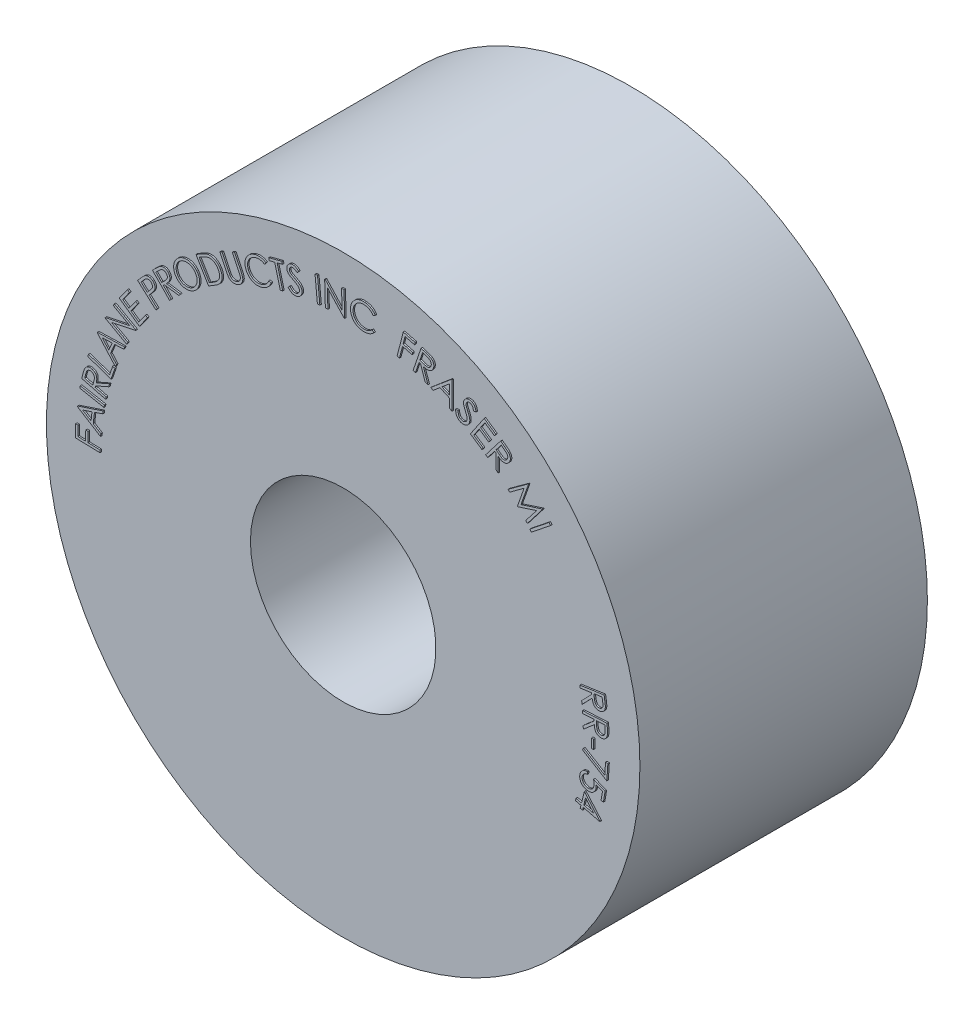
from build123d import *

# Parameters (mm, degrees)
SKETCH1_R          = 50.8
BASE_EXTRUDE_DEPTH = 49.2125
SKETCH2_R          = 15.875
CUT_EXTRUDE1_DEPTH = 88.081284765
LETTERING_DEPTH    = 0.254
LETTERING_2_DEPTH  = 0.254
LETTERING_3_DEPTH  = 0.254
LETTERING_4_DEPTH  = 0.254
LETTERING_5_DEPTH  = 0.254
LETTERING_6_DEPTH  = 0.254
LETTERING_7_DEPTH  = 0.254
LETTERING_8_DEPTH  = 0.254
LETTERING_9_DEPTH  = 0.254
LETTERING_10_DEPTH = 0.254
LETTERING_11_DEPTH = 0.254
LETTERING_12_DEPTH = 0.254
LETTERING_13_DEPTH = 0.254
LETTERING_14_DEPTH = 0.254
LETTERING_15_DEPTH = 0.254
LETTERING_16_DEPTH = 0.254
LETTERING_17_DEPTH = 0.254
LETTERING_18_DEPTH = 0.254
LETTERING_19_DEPTH = 0.254
LETTERING_20_DEPTH = 0.254
LETTERING_21_DEPTH = 0.254
LETTERING_22_DEPTH = 0.254
LETTERING_23_DEPTH = 0.254
LETTERING_24_DEPTH = 0.254
LETTERING_25_DEPTH = 0.254
LETTERING_26_DEPTH = 0.254
LETTERING_27_DEPTH = 0.254
LETTERING_28_DEPTH = 0.254
LETTERING_29_DEPTH = 0.254
LETTERING_30_DEPTH = 0.254
LETTERING_31_DEPTH = 0.254
LETTERING_32_DEPTH = 0.254
LETTERING_33_DEPTH = 0.254


with BuildPart() as part:
    # Sketch1 → Base-Extrude (new body)
    with BuildSketch(Plane.XY):
        Circle(SKETCH1_R)
    extrude(amount=-BASE_EXTRUDE_DEPTH)

    # Sketch2 → Cut-Extrude1 (cut, through all)
    with BuildSketch(Plane(origin=(0, 0, -49.2125), x_dir=(-1, 0, 0), z_dir=(0, 0, -1))):
        Circle(SKETCH2_R)
    extrude(amount=-CUT_EXTRUDE1_DEPTH, mode=Mode.SUBTRACT)


with BuildPart() as body_2:
    # Sketch5 → Lettering (new body)
    with BuildSketch(Plane(origin=(0, 0, 0), x_dir=(-1, 0, 0), z_dir=(0, 0, -1))):
        Polygon((45.594649802, 0.622381885), (45.539794651, 2.733429859), (45.124015071, 2.722897756), (45.168164858, 1.030167526), (43.851334134, 0.995527533), (43.807184347, 2.688257763), (43.391404768, 2.67772566), (43.435554555, 0.98499543), (41.371212845, 0.930778562), (41.381918208, 0.512460819), align=None)
    extrude(amount=-LETTERING_DEPTH)


with BuildPart() as body_3:
    # Sketch5 → Lettering 2 (new body)
    with BuildSketch(Plane(origin=(0, 0, 0), x_dir=(-1, 0, 0), z_dir=(0, 0, -1))):
        Polygon((45.218648858, 5.518746385), (40.816320617, 6.981548428), (40.868097476, 6.533181172), (42.318504026, 6.036732369), (42.527231914, 4.236675526), (41.22941291, 3.424026498), (41.283593945, 2.958784584), (45.23060348, 5.416890771), align=None)
        Polygon((44.338590234, 5.365149861), (42.908829358, 4.471141278), (42.742706493, 5.899171936), align=None, mode=Mode.SUBTRACT)
    extrude(amount=-LETTERING_2_DEPTH)


with BuildPart() as body_4:
    # Sketch5 → Lettering 3 (new body)
    with BuildSketch(Plane(origin=(0, 0, 0), x_dir=(-1, 0, 0), z_dir=(0, 0, -1))):
        Polygon((44.824821141, 8.360737114), (44.745908503, 8.773715687), (40.61407041, 7.982863256), (40.692983048, 7.569884683), align=None)
    extrude(amount=-LETTERING_3_DEPTH)


with BuildPart() as body_5:
    # Sketch5 → Lettering 4 (new body)
    with BuildSketch(Plane(origin=(0, 0, 0), x_dir=(-1, 0, 0), z_dir=(0, 0, -1))):
        with BuildLine():
            Line((44.495105305, 9.961160019), (44.289678214, 10.776487634))
            add(Edge.make_bspline(
                [(44.289678214, 10.776487634), (44.275935739, 10.831003465), (44.249571479, 10.935589401), (44.207709229, 11.084302795), (44.170400641, 11.219605675), (44.132957568, 11.34025658), (44.097466934, 11.447049721), (44.064297386, 11.539910775), (44.031870375, 11.617983213), (44.009748225, 11.664640415), (43.999677465, 11.685880372)],
                knots=[0, 0, 0, 0, 1.411397808, 2.707697115, 3.878489397, 4.934857314, 5.878752216, 6.70374791, 7.409901634, 8, 8, 8, 8], degree=3))
            add(Edge.make_bspline(
                [(43.999677465, 11.685880372), (43.984872961, 11.713891173), (43.955600571, 11.769275877), (43.90346673, 11.846447535), (43.847733107, 11.918701907), (43.785814785, 11.984062375), (43.719669363, 12.044101718), (43.648564011, 12.098435337), (43.573029491, 12.147701834), (43.492356412, 12.189407136), (43.408762557, 12.22533209), (43.32233098, 12.253191018), (43.23365037, 12.271734849), (43.142811289, 12.283081522), (43.049764998, 12.286563383), (42.954706832, 12.281537703), (42.857710044, 12.268011666), (42.793129536, 12.253413823), (42.760054813, 12.24593758)],
                knots=[0, 0, 0, 0, 1.028847715, 2.03430193, 3.021932858, 3.991151746, 4.955701776, 5.921956152, 6.896254634, 7.882218169, 8.869208125, 9.85019548, 10.827606745, 11.808938095, 12.821917018, 13.849123172, 14.898434546, 16, 16, 16, 16], degree=3))
            add(Edge.make_bspline(
                [(42.760054813, 12.24593758), (42.706342987, 12.230484385), (42.601414678, 12.200295919), (42.455403583, 12.132004161), (42.325265309, 12.045749391), (42.209798217, 11.944449886), (42.112322145, 11.826768218), (42.034559097, 11.695139939), (41.977253613, 11.550200469), (41.946127672, 11.420305552), (41.930879627, 11.309082343), (41.926174355, 11.218583844), (41.927272711, 11.122337357), (41.933234284, 11.020086111), (41.944720311, 10.911810277), (41.962131173, 10.797403042), (41.985938383, 10.677257133), (42.005025035, 10.595453207), (42.014827423, 10.553440927)],
                knots=[0, 0, 0, 0, 1.274673656, 2.490128562, 3.66288459, 4.829229537, 5.984594004, 7.136853618, 8.3053395, 9.530097908, 10.176866583, 10.866494557, 11.596954629, 12.373654334, 13.204260708, 14.082119641, 15.015028616, 16, 16, 16, 16], degree=3))
            Line((42.014827423, 10.553440927), (39.74001881, 11.544982083))
            Line((39.74001881, 11.544982083), (39.868068259, 11.03871152))
            Line((39.868068259, 11.03871152), (42.142010172, 10.050557734))
            Line((42.142010172, 10.050557734), (42.201066452, 9.816426011))
            Line((42.201066452, 9.816426011), (40.297929523, 9.335429426))
            Line((40.297929523, 9.335429426), (40.401247848, 8.92664655))
            Line((40.401247848, 8.92664655), (44.495105305, 9.961160019))
        make_face()
        with BuildLine():
            Line((43.990524889, 10.268761157), (42.599687218, 9.917144236))
            Line((42.599687218, 9.917144236), (42.416429358, 10.620104469))
            add(Edge.make_bspline(
                [(42.416429358, 10.620104469), (42.408333804, 10.653069893), (42.392643635, 10.716960892), (42.37344156, 10.810198802), (42.356482643, 10.897044738), (42.346252293, 10.978123351), (42.337669107, 11.05321955), (42.335096618, 11.122571777), (42.335164262, 11.185850756), (42.341834895, 11.261132279), (42.360167491, 11.348275004), (42.395562167, 11.445902716), (42.446861215, 11.534973148), (42.51058358, 11.615785831), (42.586955055, 11.68547595), (42.671908504, 11.74427326), (42.765919915, 11.790713807), (42.833414035, 11.810277749), (42.86770664, 11.820217853)],
                knots=[0, 0, 0, 0, 1.114486731, 2.160010806, 3.125731205, 4.018726408, 4.842675846, 5.606504467, 6.296182393, 6.919177808, 8.085046569, 9.209691091, 10.314589575, 11.445612564, 12.575721102, 13.696067505, 14.829411402, 16, 16, 16, 16], degree=3))
            add(Edge.make_bspline(
                [(42.86770664, 11.820217853), (42.901756327, 11.827646462), (42.968980439, 11.842312725), (43.071657438, 11.84405198), (43.172717741, 11.832909826), (43.270723655, 11.80531973), (43.364181248, 11.766702877), (43.448232731, 11.713227143), (43.523066656, 11.649346868), (43.577414288, 11.58573), (43.615437129, 11.525870431), (43.645233897, 11.473360719), (43.672559767, 11.411932936), (43.701257719, 11.343456513), (43.728902058, 11.266483674), (43.756521083, 11.181730916), (43.783399109, 11.088628885), (43.800207412, 11.023770655), (43.808962222, 10.989988455)],
                knots=[0, 0, 0, 0, 1.165699301, 2.301433845, 3.423967272, 4.563372297, 5.702895527, 6.801863819, 7.887680184, 8.991621393, 9.590485178, 10.263346308, 11.013446394, 11.842255926, 12.752196501, 13.754009461, 14.830148459, 16, 16, 16, 16], degree=3))
            Line((43.808962222, 10.989988455), (43.990524889, 10.268761157))
        make_face(mode=Mode.SUBTRACT)
    extrude(amount=-LETTERING_4_DEPTH)


with BuildPart() as body_6:
    # Sketch5 → Lettering 5 (new body)
    with BuildSketch(Plane(origin=(0, 0, 0), x_dir=(-1, 0, 0), z_dir=(0, 0, -1))):
        Polygon((43.471006489, 13.749982125), (43.331146173, 14.151380172), (39.731266768, 12.896929102), (39.198252524, 14.426814765), (38.813450786, 14.293127718), (39.486325346, 12.361844008), align=None)
    extrude(amount=-LETTERING_5_DEPTH)


with BuildPart() as body_7:
    # Sketch5 → Lettering 6 (new body)
    with BuildSketch(Plane(origin=(0, 0, 0), x_dir=(-1, 0, 0), z_dir=(0, 0, -1))):
        Polygon((41.788049998, 18.16079532), (37.140083918, 18.309758043), (37.318023023, 17.89438907), (38.852991818, 17.831067455), (39.567419236, 16.161279222), (38.552066008, 15.009228682), (38.737125536, 14.577893002), (41.828915912, 18.066734403), align=None)
        Polygon((40.986907461, 17.762085289), (39.867312175, 16.495041381), (39.300329145, 17.819861385), align=None, mode=Mode.SUBTRACT)
    extrude(amount=-LETTERING_6_DEPTH)


with BuildPart() as body_8:
    # Sketch5 → Lettering 7 (new body)
    with BuildSketch(Plane(origin=(0, 0, 0), x_dir=(-1, 0, 0), z_dir=(0, 0, -1))):
        Polygon((36.815341451, 18.881763365), (40.50571515, 20.9344475), (40.461129965, 21.014843643), (36.270666514, 21.896743908), (39.096049205, 23.468103111), (38.89367595, 23.831926374), (35.203302251, 21.779242239), (35.249627358, 21.69680548), (39.393259439, 20.814445156), (36.603267552, 19.262336895), align=None)
    extrude(amount=-LETTERING_7_DEPTH)


with BuildPart() as body_9:
    # Sketch5 → Lettering 8 (new body)
    with BuildSketch(Plane(origin=(0, 0, 0), x_dir=(-1, 0, 0), z_dir=(0, 0, -1))):
        Polygon((38.065300392, 25.080943304), (36.659934692, 27.046969711), (36.321667749, 26.805118146), (37.481625244, 25.182333196), (36.40882447, 24.416177529), (35.259044255, 26.025132369), (34.923264569, 25.785059125), (36.073044785, 24.176104285), (34.726645748, 23.214333383), (33.576865533, 24.823288223), (33.23859859, 24.581436658), (34.633787011, 22.629240362), align=None)
    extrude(amount=-LETTERING_8_DEPTH)


with BuildPart() as body_10:
    # Sketch5 → Lettering 9 (new body)
    with BuildSketch(Plane(origin=(0, 0, 0), x_dir=(-1, 0, 0), z_dir=(0, 0, -1))):
        with BuildLine():
            Line((34.943189137, 29.294273742), (34.37916377, 29.920570104))
            add(Edge.make_bspline(
                [(34.37916377, 29.920570104), (34.340137114, 29.963407244), (34.265425627, 30.04541341), (34.156717965, 30.161403519), (34.056913805, 30.265681182), (33.964924048, 30.35716072), (33.88216797, 30.437092095), (33.806863192, 30.503742041), (33.741290646, 30.559652597), (33.698194006, 30.590147147), (33.678663853, 30.603966397)],
                knots=[0, 0, 0, 0, 1.418731658, 2.715978308, 3.891937779, 4.952332846, 5.892165235, 6.708038219, 7.414520211, 8, 8, 8, 8], degree=3))
            add(Edge.make_bspline(
                [(33.678663853, 30.603966397), (33.653024366, 30.620698756), (33.602049087, 30.65396528), (33.522011107, 30.695995364), (33.440470561, 30.731339722), (33.357134387, 30.758611675), (33.272306776, 30.779400045), (33.186067704, 30.793837051), (33.097989452, 30.799989858), (33.009087108, 30.800356491), (32.919631698, 30.792722651), (32.83155659, 30.77620135), (32.744794772, 30.751883322), (32.660170291, 30.718012453), (32.576136535, 30.677698871), (32.494790915, 30.626814485), (32.413528238, 30.570033703), (32.363033559, 30.525584133), (32.337336155, 30.502963164)],
                knots=[0, 0, 0, 0, 1.006696397, 2.001468581, 2.969678172, 3.927110584, 4.882146642, 5.840662224, 6.799583681, 7.783430214, 8.762828218, 9.748036113, 10.727301674, 11.721769573, 12.743133164, 13.788760557, 14.874671297, 16, 16, 16, 16], degree=3))
            add(Edge.make_bspline(
                [(32.337336155, 30.502963164), (32.312003697, 30.479414325), (32.262537725, 30.433431173), (32.196754069, 30.358528805), (32.138521281, 30.282479013), (32.088311414, 30.204086466), (32.045161966, 30.124018237), (32.012446076, 30.040719794), (31.985922882, 29.956103413), (31.968378632, 29.869503723), (31.959750518, 29.781703876), (31.956749319, 29.693608568), (31.9633049, 29.605349734), (31.977446901, 29.517185042), (31.998008214, 29.428354123), (32.027270601, 29.339662989), (32.064447401, 29.250620188), (32.094299518, 29.192691655), (32.109531597, 29.16313355)],
                knots=[0, 0, 0, 0, 1.121038665, 2.18902041, 3.22832814, 4.224701267, 5.205389193, 6.172659839, 7.12217365, 8.07839041, 9.031966898, 9.980639511, 10.93351069, 11.896820039, 12.874289139, 13.887225009, 14.921954001, 16, 16, 16, 16], degree=3))
            add(Edge.make_bspline(
                [(32.109531597, 29.16313355), (32.123190282, 29.139606601), (32.152955303, 29.088336649), (32.207003698, 29.008601449), (32.271867718, 28.917951285), (32.350697993, 28.818394535), (32.43967562, 28.707265493), (32.541814371, 28.586922234), (32.655085103, 28.455689034), (32.735918287, 28.365718324), (32.778092257, 28.318776933)],
                knots=[0, 0, 0, 0, 0.605087918, 1.31860827, 2.141894304, 3.084660958, 4.143199406, 5.309165043, 6.596081599, 8, 8, 8, 8], degree=3))
            Line((32.778092257, 28.318776933), (32.980138898, 28.094596815))
            Line((32.980138898, 28.094596815), (31.518711092, 26.777976583))
            Line((31.518711092, 26.777976583), (31.801829463, 26.463409387))
            Line((31.801829463, 26.463409387), (34.943189137, 29.294273742))
        make_face()
        with BuildLine():
            Line((34.355068107, 29.333935387), (33.287138018, 28.371818183))
            Line((33.287138018, 28.371818183), (32.8011435, 28.896995975))
            add(Edge.make_bspline(
                [(32.8011435, 28.896995975), (32.777743095, 28.923089882), (32.732579583, 28.973451936), (32.669956093, 29.04865534), (32.615012087, 29.120925544), (32.565107335, 29.1880359), (32.522132832, 29.251526096), (32.486671241, 29.311694929), (32.457755201, 29.368110625), (32.4276595, 29.437248536), (32.402003639, 29.522249857), (32.389236883, 29.624991612), (32.391208759, 29.727886835), (32.410339432, 29.829489124), (32.443277564, 29.927936735), (32.492545201, 30.019197762), (32.553394949, 30.10467367), (32.603852629, 30.153765301), (32.629508915, 30.178726991)],
                knots=[0, 0, 0, 0, 1.141164893, 2.202483853, 3.185228217, 4.096733766, 4.925335043, 5.680106092, 6.369350246, 6.988133149, 8.1338542, 9.245539469, 10.346351126, 11.471066473, 12.599241102, 13.712030726, 14.836633092, 16, 16, 16, 16], degree=3))
            add(Edge.make_bspline(
                [(32.629508915, 30.178726991), (32.656346125, 30.200932078), (32.709663605, 30.245046919), (32.799566488, 30.296119561), (32.895409564, 30.33386903), (32.995961988, 30.356863288), (33.098008322, 30.365496528), (33.198488209, 30.359699366), (33.295074958, 30.336828893), (33.373343012, 30.305901993), (33.435164961, 30.270561355), (33.486216184, 30.238138034), (33.538808179, 30.196230761), (33.596403321, 30.149660714), (33.656212091, 30.094323161), (33.720262557, 30.03307088), (33.786892909, 29.963729595), (33.831627886, 29.914585883), (33.854847261, 29.889078187)],
                knots=[0, 0, 0, 0, 1.161690955, 2.30793115, 3.435983368, 4.591943052, 5.740048317, 6.846718257, 7.938424564, 9.042311845, 9.643705527, 10.315138762, 11.060027057, 11.887737231, 12.788876071, 13.780268634, 14.847864107, 16, 16, 16, 16], degree=3))
            Line((33.854847261, 29.889078187), (34.355068107, 29.333935387))
        make_face(mode=Mode.SUBTRACT)
    extrude(amount=-LETTERING_9_DEPTH)


with BuildPart() as body_11:
    # Sketch5 → Lettering 10 (new body)
    with BuildSketch(Plane(origin=(0, 0, 0), x_dir=(-1, 0, 0), z_dir=(0, 0, -1))):
        with BuildLine():
            Line((32.403883108, 32.072289819), (31.804170411, 32.657910713))
            add(Edge.make_bspline(
                [(31.804170411, 32.657910713), (31.763901983, 32.696810387), (31.686680976, 32.771406595), (31.575135095, 32.877807715), (31.471057646, 32.971644678), (31.377494997, 33.05627669), (31.291821168, 33.128509527), (31.214863646, 33.189834875), (31.147020646, 33.240229117), (31.103532105, 33.268401569), (31.083835495, 33.281161293)],
                knots=[0, 0, 0, 0, 1.408619808, 2.701248729, 3.877972229, 4.93405403, 5.875085697, 6.696633533, 7.409685871, 8, 8, 8, 8], degree=3))
            add(Edge.make_bspline(
                [(31.083835495, 33.281161293), (31.056420597, 33.296905149), (31.002356691, 33.327953024), (30.918926208, 33.367996951), (30.833403723, 33.39817982), (30.747594721, 33.424026873), (30.659600111, 33.439646784), (30.570957402, 33.449438098), (30.481099277, 33.451080545), (30.390793901, 33.445105756), (30.301097149, 33.431661026), (30.213053663, 33.410611196), (30.127459805, 33.38094501), (30.044423895, 33.342903722), (29.963515633, 33.297251439), (29.885267173, 33.2430802), (29.809129758, 33.181134337), (29.761760137, 33.134561682), (29.737743087, 33.110948704)],
                knots=[0, 0, 0, 0, 1.029776719, 2.030784548, 3.00900027, 3.98160888, 4.946514924, 5.915454947, 6.884482479, 7.869952659, 8.860443664, 9.835664243, 10.814703106, 11.806477408, 12.807188712, 13.836965431, 14.90331168, 16, 16, 16, 16], degree=3))
            add(Edge.make_bspline(
                [(29.737743087, 33.110948704), (29.70044807, 33.069657465), (29.62761195, 32.989016839), (29.538348152, 32.85534739), (29.472227094, 32.714148901), (29.427542504, 32.567154698), (29.406773292, 32.416350102), (29.408406597, 32.263802029), (29.435222426, 32.110940412), (29.475911574, 31.984168422), (29.520887871, 31.881957735), (29.56420475, 31.802640665), (29.614616237, 31.72100062), (29.673573843, 31.637550251), (29.740085057, 31.551910859), (29.815440209, 31.464552262), (29.897177732, 31.374107822), (29.956266464, 31.314956723), (29.986548971, 31.284642254)],
                knots=[0, 0, 0, 0, 1.273379556, 2.48687443, 3.66573893, 4.833059147, 5.992540981, 7.139296853, 8.313492988, 9.53393, 10.179659638, 10.868949053, 11.602269754, 12.376501162, 13.208271557, 14.085119548, 15.018638933, 16, 16, 16, 16], degree=3))
            Line((29.986548971, 31.284642254), (27.534766947, 30.941079671))
            Line((27.534766947, 30.941079671), (27.908453899, 30.576605156))
            Line((27.908453899, 30.576605156), (30.357575259, 30.922589609))
            Line((30.357575259, 30.922589609), (30.529301839, 30.754923372))
            Line((30.529301839, 30.754923372), (29.161251773, 29.353537606))
            Line((29.161251773, 29.353537606), (29.462014909, 29.059496324))
            Line((29.462014909, 29.059496324), (32.403883108, 32.072289819))
        make_face()
        with BuildLine():
            Line((31.81476952, 32.070929092), (30.81523042, 31.047664717))
            Line((30.81523042, 31.047664717), (30.293353566, 31.548650858))
            add(Edge.make_bspline(
                [(30.293353566, 31.548650858), (30.269160158, 31.572566484), (30.222441282, 31.618748949), (30.157130396, 31.687838743), (30.098817031, 31.754124969), (30.046336796, 31.816670747), (30.001128485, 31.876841444), (29.961342519, 31.933397945), (29.929287682, 31.987660267), (29.895288266, 32.055087365), (29.86504575, 32.138560956), (29.84587895, 32.240500817), (29.84117829, 32.342955739), (29.855384741, 32.444936024), (29.881834724, 32.544596765), (29.925918368, 32.637861071), (29.979522503, 32.727262233), (30.026911397, 32.778668365), (30.050962455, 32.804758272)],
                knots=[0, 0, 0, 0, 1.119751307, 2.16230485, 3.128661666, 4.025646861, 4.848951293, 5.605449732, 6.300575387, 6.921283343, 8.089731325, 9.208244825, 10.324860272, 11.449241221, 12.585037497, 13.704479481, 14.834965502, 16, 16, 16, 16], degree=3))
            add(Edge.make_bspline(
                [(30.050962455, 32.804758272), (30.076088101, 32.828581897), (30.125809585, 32.875726796), (30.211505443, 32.931434779), (30.303733874, 32.973644142), (30.400949134, 33.002626141), (30.500888952, 33.017755761), (30.600303546, 33.017434234), (30.697455901, 33.001538708), (30.77614709, 32.974323535), (30.840405741, 32.945333441), (30.892155076, 32.914559263), (30.947979328, 32.877104661), (31.008418897, 32.833618125), (31.072177444, 32.782672711), (31.139412115, 32.724313093), (31.211014251, 32.65921047), (31.259408424, 32.612625998), (31.284472885, 32.588498823)],
                knots=[0, 0, 0, 0, 1.161090417, 2.297697735, 3.413774923, 4.55828642, 5.693901847, 6.796774883, 7.884337498, 8.984591657, 9.583368709, 10.249700402, 11.003628445, 11.84143654, 12.74981972, 13.743834014, 14.831479519, 16, 16, 16, 16], degree=3))
            Line((31.284472885, 32.588498823), (31.81476952, 32.070929092))
        make_face(mode=Mode.SUBTRACT)
    extrude(amount=-LETTERING_10_DEPTH)


with BuildPart() as body_12:
    # Sketch5 → Lettering 11 (new body)
    with BuildSketch(Plane(origin=(0, 0, 0), x_dir=(-1, 0, 0), z_dir=(0, 0, -1))):
        with BuildLine():
            add(Edge.make_bspline(
                [(27.93438424, 36.107806707), (27.871872901, 36.154733951), (27.74889082, 36.247056563), (27.551715037, 36.36081739), (27.351335474, 36.454735056), (27.146266685, 36.527715327), (26.935992902, 36.576665387), (26.721359891, 36.6054192), (26.502022892, 36.610770129), (26.28065684, 36.595004892), (26.061887037, 36.559800436), (25.850884824, 36.503952677), (25.650910741, 36.427102404), (25.459849739, 36.332904725), (25.280490282, 36.215986289), (25.109669945, 36.081922562), (24.949612684, 35.927007859), (24.854241911, 35.811065323), (24.805695516, 35.752047324)],
                knots=[0, 0, 0, 0, 1.066779973, 2.09873639, 3.102234404, 4.086338383, 5.065636585, 6.045725979, 7.039049196, 8.056751387, 9.072892476, 10.061281316, 11.032110248, 11.994519291, 12.965163956, 13.950705853, 14.956851869, 16, 16, 16, 16], degree=3))
            add(Edge.make_bspline(
                [(24.805695516, 35.752047324), (24.760434513, 35.691333642), (24.671421265, 35.571930144), (24.560449282, 35.380978271), (24.470711236, 35.184733303), (24.402142208, 34.982539944), (24.35459849, 34.774767391), (24.328510935, 34.561399219), (24.324896483, 34.342876517), (24.341144034, 34.121774206), (24.377587892, 33.903013681), (24.433206582, 33.691720201), (24.510145767, 33.491439209), (24.604595303, 33.300652685), (24.719948585, 33.121140219), (24.853588137, 32.951357424), (25.006893072, 32.792293488), (25.121753534, 32.697446855), (25.180073944, 32.649288468)],
                knots=[0, 0, 0, 0, 1.043762673, 2.052731943, 3.039138881, 4.015548809, 4.992075479, 5.973763756, 6.97464883, 8.001587832, 9.027305057, 10.029260163, 11.009585005, 11.9814076, 12.960343819, 13.946820095, 14.957497704, 16, 16, 16, 16], degree=3))
            add(Edge.make_bspline(
                [(25.180073944, 32.649288468), (25.241475438, 32.603615095), (25.362576627, 32.513534229), (25.555836155, 32.401449877), (25.753761077, 32.309844923), (25.956831853, 32.239967192), (26.165454349, 32.191237968), (26.379177507, 32.165378089), (26.597882589, 32.158681947), (26.818906595, 32.175700604), (27.037312678, 32.212166303), (27.248291775, 32.266575395), (27.447770674, 32.342322197), (27.636918949, 32.435718902), (27.815307573, 32.54874432), (27.982533399, 32.681139504), (28.140764662, 32.831236776), (28.234029696, 32.944622151), (28.281438633, 33.002258758)],
                knots=[0, 0, 0, 0, 1.056095251, 2.082919834, 3.078559018, 4.063789934, 5.04338256, 6.031401278, 7.031979394, 8.060235061, 9.087267387, 10.086595904, 11.063883566, 12.028513956, 12.995172135, 13.974196811, 14.970233846, 16, 16, 16, 16], degree=3))
            add(Edge.make_bspline(
                [(28.281438633, 33.002258758), (28.311631322, 33.042429813), (28.371523772, 33.122116084), (28.451821353, 33.246893124), (28.523313731, 33.375153139), (28.585835507, 33.506860459), (28.638949783, 33.642316261), (28.683716991, 33.780702067), (28.71929477, 33.922759313), (28.745683549, 34.067725843), (28.763540372, 34.213662261), (28.770918805, 34.358974466), (28.769319329, 34.502884495), (28.758416688, 34.645542193), (28.736918596, 34.786730716), (28.70639727, 34.926311257), (28.666818781, 35.0647575), (28.616633872, 35.200547247), (28.559450806, 35.333538803), (28.493400165, 35.461223211), (28.419101349, 35.583061454), (28.337555729, 35.699574451), (28.248745141, 35.810926407), (28.151695135, 35.915882821), (28.047273255, 36.015809521), (27.972275301, 36.076927963), (27.93438424, 36.107806707)],
                knots=[0, 0, 0, 0, 1.040583818, 2.064178929, 3.070413409, 4.080184632, 5.081432988, 6.081910724, 7.090747957, 8.112247854, 9.13206848, 10.133796033, 11.123543321, 12.111193005, 13.094616631, 14.079085415, 15.068832703, 16.074385613, 17.075497014, 18.065538651, 19.049171397, 20.029103112, 21.009384578, 21.996791277, 22.987922973, 24, 24, 24, 24], degree=3))
        make_face()
        with BuildLine():
            add(Edge.make_bspline(
                [(27.663863999, 35.795684008), (27.693819271, 35.771448378), (27.75367732, 35.723019589), (27.836176153, 35.642710125), (27.914467367, 35.558717855), (27.98487923, 35.468315642), (28.050684956, 35.373624094), (28.109789306, 35.273597361), (28.164214006, 35.168867226), (28.210694959, 35.059074655), (28.2518175, 34.946975355), (28.285121041, 34.833580157), (28.310576997, 34.719614748), (28.328792434, 34.604776496), (28.337565885, 34.489229269), (28.340397897, 34.37312684), (28.333353163, 34.256596828), (28.321038073, 34.139592193), (28.299563984, 34.023644936), (28.270469561, 33.90951478), (28.234257268, 33.797339859), (28.190138305, 33.687372192), (28.138405666, 33.579782056), (28.07895443, 33.474639154), (28.011926839, 33.37160493), (27.96219236, 33.305592753), (27.937029456, 33.272194231)],
                knots=[0, 0, 0, 0, 0.982092325, 1.962463608, 2.933060363, 3.907983842, 4.881654016, 5.871808291, 6.868683177, 7.889151733, 8.909849398, 9.912234219, 10.900444902, 11.885970296, 12.874364996, 13.853436877, 14.845085646, 15.849102026, 16.85200509, 17.849010277, 18.850798788, 19.855668736, 20.868188422, 21.892823832, 22.933885041, 24, 24, 24, 24], degree=3))
            add(Edge.make_bspline(
                [(27.937029456, 33.272194231), (27.898075869, 33.224988438), (27.821315155, 33.131966186), (27.692269655, 33.007928563), (27.555731037, 32.898474279), (27.41018335, 32.805604866), (27.256081823, 32.729457254), (27.094545156, 32.667232141), (26.924255661, 32.621921427), (26.74775919, 32.593583527), (26.569750515, 32.580188372), (26.394092115, 32.584545241), (26.22320219, 32.604267703), (26.057095354, 32.64205341), (25.895564339, 32.696576392), (25.739007462, 32.768276704), (25.586561433, 32.855874003), (25.491604727, 32.926358008), (25.443386365, 32.9621493)],
                knots=[0, 0, 0, 0, 1.049444703, 2.068002716, 3.064789541, 4.048031146, 5.024032031, 6.00960378, 7.013645447, 8.041664186, 9.072893259, 10.072272941, 11.052243037, 12.019806954, 12.989750807, 13.972274333, 14.970334857, 16, 16, 16, 16], degree=3))
            add(Edge.make_bspline(
                [(25.443386365, 32.9621493), (25.411974216, 32.987454702), (25.349514092, 33.03777213), (25.263550279, 33.120607088), (25.183185593, 33.207119106), (25.109474983, 33.298315551), (25.041233872, 33.393547179), (24.979631462, 33.49365466), (24.92543915, 33.598518265), (24.876456603, 33.706775235), (24.835365353, 33.817855092), (24.801070891, 33.930096322), (24.77595533, 34.043332704), (24.758626127, 34.157298998), (24.747292914, 34.271963637), (24.745100753, 34.387487222), (24.752226106, 34.503458207), (24.764931356, 34.619889845), (24.786302351, 34.735568433), (24.815140076, 34.849543164), (24.852104917, 34.961206668), (24.89556395, 35.070965678), (24.948263521, 35.177621244), (25.006360337, 35.283028797), (25.073341132, 35.38542189), (25.122875107, 35.451079556), (25.147818267, 35.484141906)],
                knots=[0, 0, 0, 0, 1.025022754, 2.038162033, 3.031560853, 4.025375472, 5.017031234, 6.008218189, 7.010621745, 8.016008958, 9.027107262, 10.019465818, 10.997461359, 11.972813094, 12.948667702, 13.92473397, 14.906497787, 15.900728033, 16.900552325, 17.894496846, 18.887167596, 19.888952734, 20.892900668, 21.909398598, 22.947263895, 24, 24, 24, 24], degree=3))
            add(Edge.make_bspline(
                [(25.147818267, 35.484141906), (25.173875527, 35.516244561), (25.225392876, 35.579714153), (25.308352907, 35.668232744), (25.395776366, 35.749149006), (25.486498734, 35.824236371), (25.581729735, 35.891760482), (25.680067375, 35.953485161), (25.783381122, 36.006315345), (25.889461502, 36.0536604), (25.99849479, 36.093550004), (26.109342379, 36.126614487), (26.222275545, 36.150275972), (26.336220218, 36.168647453), (26.451860065, 36.177249954), (26.56893022, 36.179550014), (26.687584834, 36.172155465), (26.807047445, 36.159262836), (26.925751723, 36.139508753), (27.041360382, 36.110218359), (27.154067532, 36.076108243), (27.263585204, 36.034932575), (27.368582674, 35.984425257), (27.471185337, 35.929474693), (27.569703993, 35.866120659), (27.632325099, 35.819276769), (27.663863999, 35.795684008)],
                knots=[0, 0, 0, 0, 1.055086069, 2.08599208, 3.093093741, 4.093843839, 5.089431231, 6.070747438, 7.054421277, 8.04838655, 9.034069183, 10.015703603, 10.99786815, 11.977086873, 12.959251419, 13.954917233, 14.963387644, 15.991082377, 17.021079122, 18.031612057, 19.032700189, 20.025722371, 21.014147265, 22.004334785, 22.994890219, 24, 24, 24, 24], degree=3))
        make_face(mode=Mode.SUBTRACT)
    extrude(amount=-LETTERING_11_DEPTH)


with BuildPart() as body_13:
    # Sketch5 → Lettering 12 (new body)
    with BuildSketch(Plane(origin=(0, 0, 0), x_dir=(-1, 0, 0), z_dir=(0, 0, -1))):
        with BuildLine():
            Line((22.780706332, 34.535075984), (24.945347495, 38.120562836))
            Line((24.945347495, 38.120562836), (24.201812985, 38.569469029))
            add(Edge.make_bspline(
                [(24.201812985, 38.569469029), (24.137090202, 38.608135012), (24.011854416, 38.682952017), (23.827741653, 38.785509979), (23.655226829, 38.876395718), (23.494228136, 38.95516275), (23.343908232, 39.020457194), (23.205310038, 39.074538452), (23.078142526, 39.116982788), (22.995934515, 39.136315916), (22.957138781, 39.145439636)],
                knots=[0, 0, 0, 0, 1.314076049, 2.542680347, 3.672936024, 4.712614641, 5.666017979, 6.528609734, 7.3056192, 8, 8, 8, 8], degree=3))
            add(Edge.make_bspline(
                [(22.957138781, 39.145439636), (22.904981497, 39.155153877), (22.801776043, 39.174375786), (22.646244548, 39.188370064), (22.492973549, 39.189154807), (22.341568009, 39.17815975), (22.192272245, 39.154203475), (22.045093178, 39.116850887), (21.899932295, 39.067569184), (21.757934718, 39.004729795), (21.619722191, 38.930836652), (21.485979761, 38.846705213), (21.359894795, 38.749199445), (21.23748308, 38.643646501), (21.12335752, 38.524516401), (21.013568992, 38.396190362), (20.910174027, 38.256171558), (20.847900379, 38.156467867), (20.816242054, 38.105781069)],
                knots=[0, 0, 0, 0, 0.998505558, 1.975778075, 2.935354187, 3.881612942, 4.830860519, 5.778360779, 6.737375849, 7.713807426, 8.698443483, 9.686296376, 10.684645892, 11.696732967, 12.726783097, 13.787253093, 14.875096259, 16, 16, 16, 16], degree=3))
            add(Edge.make_bspline(
                [(20.816242054, 38.105781069), (20.79026283, 38.06101054), (20.739077425, 37.972801684), (20.672053985, 37.837397506), (20.614668828, 37.701721651), (20.567609868, 37.565533478), (20.529382752, 37.429290307), (20.501803432, 37.292347302), (20.482468788, 37.155064473), (20.475007493, 37.017755404), (20.475550002, 36.882618373), (20.483944164, 36.750937414), (20.502293978, 36.623533358), (20.527702725, 36.500026897), (20.561815347, 36.380550888), (20.604199256, 36.265116595), (20.655264177, 36.153913822), (20.714819655, 36.045488135), (20.786260346, 35.940172143), (20.869458154, 35.835662527), (20.965394401, 35.731588548), (21.076262998, 35.629902566), (21.197318319, 35.525524305), (21.333546639, 35.423879214), (21.481822067, 35.321902409), (21.586759404, 35.256973842), (21.640614719, 35.223651588)],
                knots=[0, 0, 0, 0, 1.090881877, 2.149303257, 3.182328058, 4.194099792, 5.18468219, 6.162784424, 7.13668499, 8.104423129, 9.058545695, 9.984204239, 10.883244176, 11.769656661, 12.640287258, 13.499857155, 14.359220498, 15.217446912, 16.104460015, 17.03821474, 18.031177811, 19.084572231, 20.207656129, 21.399170097, 22.665217556, 24, 24, 24, 24], degree=3))
            Line((21.640614719, 35.223651588), (22.780706332, 34.535075984))
        make_face()
        with BuildLine():
            Line((22.642416559, 35.081415863), (22.227805515, 35.331702853))
            add(Edge.make_bspline(
                [(22.227805515, 35.331702853), (22.16848618, 35.368051278), (22.054546557, 35.437868746), (21.892683207, 35.541508554), (21.746021623, 35.638551228), (21.615892066, 35.730778937), (21.501941491, 35.817581283), (21.403591298, 35.897825279), (21.320910928, 35.972488522), (21.273971255, 36.023043866), (21.252166784, 36.046527893)],
                knots=[0, 0, 0, 0, 1.376342972, 2.643657395, 3.80231901, 4.855258616, 5.79854291, 6.635692397, 7.366250251, 8, 8, 8, 8], degree=3))
            add(Edge.make_bspline(
                [(21.252166784, 36.046527893), (21.226210086, 36.078103765), (21.174949054, 36.140461922), (21.107339139, 36.239810669), (21.049265881, 36.342298569), (21.001384586, 36.448493144), (20.961836805, 36.557608869), (20.932423712, 36.670285328), (20.911857309, 36.78616733), (20.901309552, 36.904829696), (20.899468691, 37.025472385), (20.909154037, 37.14717903), (20.928102005, 37.269091896), (20.957096761, 37.39172937), (20.99750888, 37.514123179), (21.046799421, 37.637072642), (21.106474079, 37.760384613), (21.153006187, 37.840614085), (21.176811954, 37.88165938)],
                knots=[0, 0, 0, 0, 0.99348562, 1.962002212, 2.917777355, 3.854153129, 4.79118454, 5.736522974, 6.682061278, 7.649601838, 8.630188696, 9.612291944, 10.61441807, 11.627608423, 12.672633999, 13.745431252, 14.846565519, 16, 16, 16, 16], degree=3))
            add(Edge.make_bspline(
                [(21.176811954, 37.88165938), (21.203147057, 37.923730687), (21.254918388, 38.006437314), (21.34165653, 38.121682045), (21.432010431, 38.228503035), (21.528358832, 38.325131092), (21.628904484, 38.413119144), (21.734947646, 38.491195932), (21.846304336, 38.559158908), (21.961603334, 38.618411256), (22.080783878, 38.666621318), (22.202128286, 38.704667882), (22.325341962, 38.732287654), (22.450720759, 38.748176944), (22.577843567, 38.752764438), (22.70665019, 38.745753588), (22.837434321, 38.730112665), (22.923941287, 38.709834979), (22.967737518, 38.699568913)],
                knots=[0, 0, 0, 0, 1.122747832, 2.207173749, 3.260824098, 4.286589374, 5.292047637, 6.281774937, 7.262593545, 8.241407496, 9.212098196, 10.168177158, 11.116348111, 12.065705155, 13.024177951, 13.990707337, 14.98274728, 16, 16, 16, 16], degree=3))
            add(Edge.make_bspline(
                [(22.967737518, 38.699568913), (23.003005361, 38.68979067), (23.078399966, 38.668887016), (23.195383875, 38.625091537), (23.324397317, 38.571182512), (23.464906318, 38.506214557), (23.616659077, 38.428959933), (23.780533486, 38.34143291), (23.95594189, 38.241330861), (24.076128802, 38.169834132), (24.138628969, 38.132654065)],
                knots=[0, 0, 0, 0, 0.672953209, 1.438620505, 2.295475502, 3.245013394, 4.285307403, 5.427534838, 6.662254512, 8, 8, 8, 8], degree=3))
            Line((24.138628969, 38.132654065), (24.391859849, 37.979466066))
            Line((24.391859849, 37.979466066), (22.642416559, 35.081415863))
        make_face(mode=Mode.SUBTRACT)
    extrude(amount=-LETTERING_12_DEPTH)


with BuildPart() as body_14:
    # Sketch5 → Lettering 13 (new body)
    with BuildSketch(Plane(origin=(0, 0, 0), x_dir=(-1, 0, 0), z_dir=(0, 0, -1))):
        with BuildLine():
            Line((20.859768927, 40.543708236), (20.480164641, 40.726859055))
            Line((20.480164641, 40.726859055), (19.372917548, 38.432610576))
            add(Edge.make_bspline(
                [(19.372917548, 38.432610576), (19.357467528, 38.400189094), (19.328138684, 38.338643243), (19.284279702, 38.252099061), (19.245952602, 38.174639505), (19.211201955, 38.107109941), (19.180801512, 38.049224746), (19.153708409, 38.001476172), (19.132560815, 37.962399165), (19.117878633, 37.940778181), (19.111546894, 37.931454062)],
                knots=[0, 0, 0, 0, 1.52408545, 2.893178494, 4.117321153, 5.191635269, 6.116277818, 6.891496702, 7.521954376, 8, 8, 8, 8], degree=3))
            add(Edge.make_bspline(
                [(19.111546894, 37.931454062), (19.088507621, 37.898259323), (19.04388897, 37.833973249), (18.968518793, 37.747822397), (18.88722427, 37.676134131), (18.800192371, 37.617054035), (18.70463544, 37.57123044), (18.598471399, 37.541580424), (18.482384173, 37.522130798), (18.358010567, 37.517571724), (18.231031979, 37.524053192), (18.107414167, 37.545183529), (17.988905481, 37.576702158), (17.914905551, 37.609356426), (17.878054668, 37.625617774)],
                knots=[0, 0, 0, 0, 1.039953723, 2.014010201, 2.939135666, 3.823504026, 4.715032415, 5.654563445, 6.652185854, 7.739656192, 8.852577028, 9.920083965, 10.964232246, 12, 12, 12, 12], degree=3))
            add(Edge.make_bspline(
                [(17.878054668, 37.625617774), (17.847239528, 37.641744647), (17.786192863, 37.673692961), (17.701610122, 37.733404869), (17.624010657, 37.801862836), (17.55381532, 37.878923319), (17.492278217, 37.962589076), (17.440342459, 38.051191346), (17.401400858, 38.144841318), (17.371275717, 38.241927998), (17.354066479, 38.343502068), (17.346142006, 38.448612387), (17.35171608, 38.557517136), (17.363326087, 38.630464875), (17.369270195, 38.66781276)],
                knots=[0, 0, 0, 0, 0.999741015, 1.980547661, 2.969914603, 3.971836369, 4.973328968, 5.953359833, 6.918532385, 7.885074463, 8.871663266, 9.875695176, 10.912395466, 12, 12, 12, 12], degree=3))
            add(Edge.make_bspline(
                [(17.369270195, 38.66781276), (17.372354783, 38.683012024), (17.379216157, 38.716821346), (17.397355051, 38.770614752), (17.419576544, 38.834067236), (17.447089811, 38.906420358), (17.482237703, 38.987013412), (17.521320067, 39.076997528), (17.566364106, 39.175971225), (17.599467099, 39.244369814), (17.616764175, 39.280109651)],
                knots=[0, 0, 0, 0, 0.562019041, 1.250158069, 2.055483425, 3.001604286, 4.056414248, 5.244021074, 6.559937544, 8, 8, 8, 8], degree=3))
            Line((17.616764175, 39.280109651), (18.724011268, 41.57435813))
            Line((18.724011268, 41.57435813), (18.345064879, 41.758044033))
            Line((18.345064879, 41.758044033), (17.237817786, 39.463795555))
            add(Edge.make_bspline(
                [(17.237817786, 39.463795555), (17.21828397, 39.422267647), (17.180077225, 39.341042036), (17.127274104, 39.220981625), (17.080962783, 39.10548382), (17.040363203, 38.994727107), (17.005630084, 38.888180729), (16.977824024, 38.785978759), (16.955435633, 38.688556433), (16.938717357, 38.595114769), (16.929159186, 38.503203352), (16.926855603, 38.411676476), (16.932540332, 38.319734048), (16.946263889, 38.227518143), (16.967110153, 38.135068751), (16.994117286, 38.041667131), (17.03035832, 37.948354128), (17.07236124, 37.854701254), (17.122218149, 37.763382473), (17.180702537, 37.677403549), (17.245226663, 37.59561262), (17.318889679, 37.521041144), (17.398756481, 37.450593901), (17.486776527, 37.38657568), (17.581027244, 37.325830226), (17.648921354, 37.292074379), (17.683412759, 37.274925813)],
                knots=[0, 0, 0, 0, 1.299337086, 2.541410229, 3.712888565, 4.821928229, 5.88082812, 6.88470307, 7.819696056, 8.710376366, 9.570582304, 10.433464776, 11.299644309, 12.17534804, 13.070153968, 13.981310728, 14.925337343, 15.901783421, 16.886069942, 17.86644408, 18.842890158, 19.83123561, 20.829896753, 21.854830446, 22.910216011, 24, 24, 24, 24], degree=3))
            add(Edge.make_bspline(
                [(17.683412759, 37.274925813), (17.721448502, 37.25745918), (17.79610506, 37.223175673), (17.910049581, 37.180459707), (18.023070722, 37.147056749), (18.13566075, 37.123012486), (18.246930111, 37.105937669), (18.357741953, 37.100111895), (18.46761875, 37.100783703), (18.575927886, 37.112251563), (18.681692907, 37.131363932), (18.783361031, 37.158381884), (18.880945788, 37.192203957), (18.973732821, 37.234728849), (19.06158199, 37.285631429), (19.144878479, 37.343662335), (19.224270297, 37.408512537), (19.272067151, 37.457754352), (19.296220191, 37.48263757)],
                knots=[0, 0, 0, 0, 1.150325532, 2.257859039, 3.342056035, 4.386971274, 5.420935566, 6.432940812, 7.434177984, 8.438546475, 9.422782135, 10.386182427, 11.32761341, 12.258692482, 13.187466296, 14.114841182, 15.047378381, 16, 16, 16, 16], degree=3))
            add(Edge.make_bspline(
                [(19.296220191, 37.48263757), (19.31176028, 37.500362112), (19.345159749, 37.538456508), (19.393976345, 37.604367073), (19.446327576, 37.681768212), (19.501304209, 37.772102802), (19.559674557, 37.874103938), (19.621571239, 37.988367427), (19.68697986, 38.114334149), (19.730110369, 38.203254821), (19.752521834, 38.249459758)],
                knots=[0, 0, 0, 0, 0.631989708, 1.358301135, 2.197749689, 3.137658637, 4.193624102, 5.349506434, 6.622751208, 8, 8, 8, 8], degree=3))
            Line((19.752521834, 38.249459758), (20.859768927, 40.543708236))
        make_face()
    extrude(amount=-LETTERING_13_DEPTH)


with BuildPart() as body_15:
    # Sketch5 → Lettering 14 (new body)
    with BuildSketch(Plane(origin=(0, 0, 0), x_dir=(-1, 0, 0), z_dir=(0, 0, -1))):
        with BuildLine():
            Line((12.974946872, 42.887224126), (13.203448793, 42.535826644))
            add(Edge.make_bspline(
                [(13.203448793, 42.535826644), (13.234948145, 42.55561303), (13.297569773, 42.594948942), (13.394502664, 42.647634845), (13.493498451, 42.692729554), (13.593443191, 42.732636824), (13.694723655, 42.766377206), (13.797554045, 42.793669077), (13.901923895, 42.814250067), (14.042770297, 42.834223217), (14.221521022, 42.842844877), (14.437400761, 42.828522484), (14.654928466, 42.789839403), (14.79659496, 42.744347151), (14.868582796, 42.721230261)],
                knots=[0, 0, 0, 0, 0.770358006, 1.531494124, 2.282975998, 3.022270747, 3.759615459, 4.492693918, 5.224344763, 5.961689476, 7.437865858, 8.920957809, 10.435384539, 12, 12, 12, 12], degree=3))
            add(Edge.make_bspline(
                [(14.868582796, 42.721230261), (14.907552333, 42.706733598), (14.985085632, 42.677891221), (15.097471426, 42.626342397), (15.204670175, 42.56774809), (15.307446164, 42.503472616), (15.405760493, 42.433137222), (15.498747086, 42.355314088), (15.587711602, 42.271953949), (15.67019186, 42.181811769), (15.747538392, 42.088197691), (15.81815524, 41.990974185), (15.880160514, 41.890197126), (15.936545892, 41.787462027), (15.983697955, 41.680949957), (16.02443858, 41.571970865), (16.05751201, 41.460016974), (16.082580322, 41.345604338), (16.101556998, 41.229801494), (16.110470563, 41.1124627), (16.112323073, 40.995008348), (16.106024603, 40.876651998), (16.091259857, 40.758202832), (16.069866936, 40.63880826), (16.038660619, 40.51932047), (16.012514818, 40.440387514), (15.999258606, 40.400367625)],
                knots=[0, 0, 0, 0, 1.039286629, 2.067751589, 3.088000498, 4.091715073, 5.096871732, 6.107603209, 7.121221473, 8.142693556, 9.160049944, 10.156146793, 11.144061752, 12.11663952, 13.083809887, 14.053455951, 15.023848639, 15.999554087, 16.980314375, 17.955123564, 18.938731654, 19.915588226, 20.915688495, 21.921366778, 22.946109767, 24, 24, 24, 24], degree=3))
            add(Edge.make_bspline(
                [(15.999258606, 40.400367625), (15.976808542, 40.341514102), (15.932630037, 40.22569881), (15.848583966, 40.062699379), (15.751997396, 39.912509963), (15.641459182, 39.775972354), (15.518242517, 39.651992763), (15.382478339, 39.540414872), (15.232933364, 39.443202592), (15.073053011, 39.358905048), (14.904931761, 39.290769015), (14.732368262, 39.23903727), (14.556351524, 39.207698536), (14.377971469, 39.192544639), (14.196882776, 39.196525903), (14.013363401, 39.21944472), (13.826676274, 39.259041705), (13.7037836, 39.299025416), (13.641152923, 39.319402602)],
                knots=[0, 0, 0, 0, 1.041590455, 2.049700641, 3.027976923, 3.991472317, 4.950655526, 5.915648265, 6.893354159, 7.896864331, 8.901746923, 9.890344549, 10.871991629, 11.854518565, 12.848060535, 13.862918494, 14.910863776, 16, 16, 16, 16], degree=3))
            add(Edge.make_bspline(
                [(13.641152923, 39.319402602), (13.573464428, 39.345632552), (13.440278083, 39.397243556), (13.253898617, 39.498037079), (13.083076307, 39.615623157), (12.928698314, 39.751834628), (12.789169865, 39.904755042), (12.666500145, 40.075812673), (12.559354824, 40.264009368), (12.502481068, 40.398904133), (12.473483598, 40.467681144)],
                knots=[0, 0, 0, 0, 1.028541682, 2.023796023, 2.996484784, 3.96331694, 4.936674434, 5.925588556, 6.942347258, 8, 8, 8, 8], degree=3))
            Line((12.473483598, 40.467681144), (12.076475198, 40.339257412))
            add(Edge.make_bspline(
                [(12.076475198, 40.339257412), (12.09090637, 40.299461897), (12.119563832, 40.220435854), (12.170136922, 40.105134007), (12.22732344, 39.993420976), (12.291033383, 39.885336889), (12.361691447, 39.781177065), (12.438698912, 39.680904011), (12.522127263, 39.584128752), (12.611412319, 39.491074831), (12.707249875, 39.40285777), (12.808692679, 39.319805253), (12.915885617, 39.242097127), (13.028425053, 39.169629556), (13.146819201, 39.102872633), (13.269890359, 39.040035771), (13.39907585, 38.983810056), (13.488107991, 38.951151945), (13.533096444, 38.934649613)],
                knots=[0, 0, 0, 0, 0.968970672, 1.924184649, 2.88027517, 3.840736413, 4.794743827, 5.760098479, 6.733726239, 7.718666556, 8.710957355, 9.714099837, 10.718556658, 11.740560896, 12.776849916, 13.829121813, 14.903042759, 16, 16, 16, 16], degree=3))
            add(Edge.make_bspline(
                [(13.533096444, 38.934649613), (13.576289591, 38.919930127), (13.661439496, 38.890912496), (13.789973822, 38.855326855), (13.916523627, 38.825666297), (14.041990445, 38.803436207), (14.165632315, 38.787126895), (14.287775242, 38.776508848), (14.40851087, 38.774770162), (14.527647684, 38.778235303), (14.645449072, 38.787841492), (14.761429957, 38.806282004), (14.876164579, 38.829518555), (14.989562091, 38.859795622), (15.100962952, 38.896941619), (15.211061286, 38.940840914), (15.319385452, 38.991395765), (15.389894436, 39.029685116), (15.425290754, 39.048906808)],
                knots=[0, 0, 0, 0, 1.118024932, 2.204046784, 3.266687058, 4.302157733, 5.325040048, 6.322196858, 7.304591649, 8.282089861, 9.242328371, 10.19848559, 11.158149265, 12.110006074, 13.072690039, 14.034152055, 15.013121812, 16, 16, 16, 16], degree=3))
            add(Edge.make_bspline(
                [(15.425290754, 39.048906808), (15.483273219, 39.084055885), (15.598224191, 39.153739375), (15.757053108, 39.276916077), (15.903080723, 39.412533859), (16.03531809, 39.561938625), (16.155326703, 39.723712531), (16.261447534, 39.899096833), (16.355269829, 40.08761012), (16.405388574, 40.220610123), (16.430876113, 40.288246351)],
                knots=[0, 0, 0, 0, 0.996849652, 1.976267092, 2.95078987, 3.924993156, 4.907319842, 5.910111232, 6.937201578, 8, 8, 8, 8], degree=3))
            add(Edge.make_bspline(
                [(16.430876113, 40.288246351), (16.454088455, 40.360339132), (16.499748878, 40.50215106), (16.543889437, 40.718750824), (16.565398039, 40.933603622), (16.564681055, 41.146544912), (16.541626892, 41.357317901), (16.49640457, 41.566184754), (16.427851262, 41.772818971), (16.339130147, 41.975877805), (16.231141401, 42.170197969), (16.10623638, 42.352022), (15.963406098, 42.516984779), (15.805688011, 42.667921962), (15.6310622, 42.803056336), (15.440342937, 42.923108724), (15.232863822, 43.027181838), (15.086274809, 43.083058098), (15.011629999, 43.111510932)],
                knots=[0, 0, 0, 0, 1.029683521, 2.025465025, 3.000266771, 3.962357897, 4.9167414, 5.879401006, 6.863870219, 7.873432653, 8.889535397, 9.883622686, 10.868647464, 11.852515714, 12.848631261, 13.866943496, 14.913823122, 16, 16, 16, 16], degree=3))
            add(Edge.make_bspline(
                [(15.011629999, 43.111510932), (14.965567963, 43.127265845), (14.874711479, 43.158342109), (14.736661244, 43.194666449), (14.59984913, 43.223889735), (14.463680749, 43.24422751), (14.328473204, 43.257184441), (14.194262075, 43.262579648), (14.060723098, 43.258306262), (13.928645397, 43.24685878), (13.798671988, 43.227345968), (13.671377744, 43.201755163), (13.54765785, 43.166693254), (13.426179343, 43.126702104), (13.308299736, 43.077868886), (13.194164626, 43.020979238), (13.081807885, 42.959236235), (13.010695609, 42.911314688), (12.974946872, 42.887224126)],
                knots=[0, 0, 0, 0, 1.09672429, 2.163267609, 3.214501679, 4.248023504, 5.263903729, 6.274196485, 7.272590791, 8.27271093, 9.25998846, 10.233024668, 11.196421638, 12.155956943, 13.113756834, 14.068522784, 15.029030242, 16, 16, 16, 16], degree=3))
        make_face()
    extrude(amount=-LETTERING_14_DEPTH)


with BuildPart() as body_16:
    # Sketch5 → Lettering 15 (new body)
    with BuildSketch(Plane(origin=(0, 0, 0), x_dir=(-1, 0, 0), z_dir=(0, 0, -1))):
        Polygon((12.386965033, 43.475264723), (12.489825606, 43.872705256), (10.246888594, 44.455338262), (10.144028021, 44.057897728), (11.055726654, 43.821680956), (10.096924475, 40.130278654), (10.513493482, 40.021716573), (11.472295661, 43.713118875), align=None)
    extrude(amount=-LETTERING_15_DEPTH)


with BuildPart() as body_17:
    # Sketch5 → Lettering 16 (new body)
    with BuildSketch(Plane(origin=(0, 0, 0), x_dir=(-1, 0, 0), z_dir=(0, 0, -1))):
        with BuildLine():
            Line((9.173304213, 41.166370141), (8.860888218, 41.443275262))
            add(Edge.make_bspline(
                [(8.860888218, 41.443275262), (8.820015614, 41.395137026), (8.741958539, 41.303204299), (8.618025439, 41.181645364), (8.493747589, 41.083017707), (8.370580399, 41.004366808), (8.246167028, 40.949481616), (8.122237299, 40.916951661), (7.998033984, 40.904128509), (7.917050879, 40.915498261), (7.8765082, 40.921190315)],
                knots=[0, 0, 0, 0, 1.294551177, 2.472288722, 3.552962361, 4.543027939, 5.461162712, 6.328428002, 7.163158688, 8, 8, 8, 8], degree=3))
            add(Edge.make_bspline(
                [(7.8765082, 40.921190315), (7.842509172, 40.92869083), (7.775074956, 40.94356747), (7.67833364, 40.980680561), (7.587862462, 41.030366714), (7.50309296, 41.089286362), (7.427596738, 41.157950814), (7.362464216, 41.23281159), (7.311437943, 41.315181252), (7.272794754, 41.402161897), (7.246042083, 41.492479932), (7.232759163, 41.584084953), (7.229847165, 41.676043489), (7.239069355, 41.736394186), (7.24370744, 41.766746156)],
                knots=[0, 0, 0, 0, 1.066125176, 2.114569717, 3.162405436, 4.223660662, 5.271245587, 6.282957599, 7.255124606, 8.229297356, 9.192893381, 10.132186526, 11.060626932, 12, 12, 12, 12], degree=3))
            add(Edge.make_bspline(
                [(7.24370744, 41.766746156), (7.251768855, 41.801167575), (7.268062309, 41.870738962), (7.316764905, 41.968641125), (7.379868169, 42.063491492), (7.433528733, 42.119672083), (7.46132426, 42.148772955)],
                knots=[0, 0, 0, 0, 0.947583219, 1.915222534, 2.920110293, 4, 4, 4, 4], degree=3))
            add(Edge.make_bspline(
                [(7.46132426, 42.148772955), (7.483169482, 42.169302589), (7.529122862, 42.212488513), (7.607872813, 42.273071823), (7.695425917, 42.337417296), (7.794395092, 42.402811246), (7.904219529, 42.469311868), (8.024156811, 42.538679755), (8.155485588, 42.607894277), (8.246724234, 42.654339821), (8.293835782, 42.678322219)],
                knots=[0, 0, 0, 0, 0.726290412, 1.527816927, 2.406021694, 3.360353039, 4.401941326, 5.518126576, 6.718471789, 8, 8, 8, 8], degree=3))
            add(Edge.make_bspline(
                [(8.293835782, 42.678322219), (8.340870807, 42.701994037), (8.430687152, 42.747196866), (8.557886028, 42.814422131), (8.672241207, 42.875492638), (8.772468527, 42.933543375), (8.859761031, 42.985901652), (8.932636019, 43.035431519), (8.9935979, 43.078454869), (9.027450986, 43.108552938), (9.042771554, 43.122174134)],
                knots=[0, 0, 0, 0, 1.448117394, 2.765271477, 3.956785932, 5.013081404, 5.950675081, 6.755073904, 7.436595689, 8, 8, 8, 8], degree=3))
            add(Edge.make_bspline(
                [(9.042771554, 43.122174134), (9.064826336, 43.143430525), (9.108134961, 43.18517136), (9.167489774, 43.251844968), (9.219464956, 43.322112367), (9.265108527, 43.394997032), (9.305027432, 43.470091891), (9.33692508, 43.548394524), (9.363757458, 43.629090781), (9.375304389, 43.684854954), (9.381104783, 43.712867089)],
                knots=[0, 0, 0, 0, 1.060736513, 2.082951432, 3.087667046, 4.084287516, 5.059565852, 6.029076906, 7.009942029, 8, 8, 8, 8], degree=3))
            add(Edge.make_bspline(
                [(9.381104783, 43.712867089), (9.387945123, 43.757316254), (9.401413954, 43.844837971), (9.399656192, 43.976579484), (9.382157912, 44.105201033), (9.346958562, 44.229653116), (9.29616152, 44.348685098), (9.227541682, 44.458326602), (9.145393287, 44.559929603), (9.047198869, 44.649363217), (8.938223401, 44.727243258), (8.820260631, 44.792131314), (8.693523831, 44.841107464), (8.604724537, 44.860724506), (8.559860588, 44.870635599)],
                knots=[0, 0, 0, 0, 1.020913351, 2.010208472, 2.982704331, 3.964666738, 4.941674871, 5.914637756, 6.895884922, 7.903114345, 8.924027696, 9.934756764, 10.956579903, 12, 12, 12, 12], degree=3))
            add(Edge.make_bspline(
                [(8.559860588, 44.870635599), (8.511324494, 44.877822455), (8.41528409, 44.892043387), (8.269515572, 44.891902283), (8.126008895, 44.870299277), (8.00771979, 44.838331899), (7.913109799, 44.801331983), (7.839255419, 44.76525384), (7.762745615, 44.72245052), (7.683353496, 44.672815749), (7.603081956, 44.614177045), (7.520000068, 44.548762576), (7.434084239, 44.476492321), (7.377212838, 44.424371884), (7.347852975, 44.397464706)],
                knots=[0, 0, 0, 0, 1.300311344, 2.572980529, 3.849002796, 5.14020213, 5.814084377, 6.540949094, 7.318599443, 8.138928146, 9.022861462, 9.953911442, 10.943706698, 12, 12, 12, 12], degree=3))
            Line((7.347852975, 44.397464706), (7.637759893, 44.079280175))
            add(Edge.make_bspline(
                [(7.637759893, 44.079280175), (7.661375612, 44.100474217), (7.707019743, 44.141437764), (7.774598994, 44.198739471), (7.83926073, 44.24895507), (7.899435163, 44.294422418), (7.957263566, 44.332697021), (8.011480611, 44.365011104), (8.062088234, 44.391761862), (8.125434266, 44.417367252), (8.203105648, 44.440601729), (8.297542567, 44.455551448), (8.393490788, 44.457023347), (8.456885883, 44.447178769), (8.488907413, 44.442206169)],
                knots=[0, 0, 0, 0, 1.183972223, 2.288364907, 3.304957322, 4.238492722, 5.101693016, 5.890765067, 6.593246381, 7.234810209, 8.437381091, 9.609597103, 10.792582349, 12, 12, 12, 12], degree=3))
            add(Edge.make_bspline(
                [(8.488907413, 44.442206169), (8.528724597, 44.43328389), (8.605448779, 44.416091449), (8.709485516, 44.36501905), (8.799951223, 44.299462893), (8.871410972, 44.215938562), (8.926007825, 44.123159195), (8.959000592, 44.022924852), (8.971892103, 43.917088139), (8.962390357, 43.846457025), (8.95750709, 43.810157325)],
                knots=[0, 0, 0, 0, 1.11053324, 2.139898986, 3.139675346, 4.140761561, 5.118276044, 6.06098657, 7.003475924, 8, 8, 8, 8], degree=3))
            add(Edge.make_bspline(
                [(8.95750709, 43.810157325), (8.952707998, 43.787812687), (8.943153061, 43.743324772), (8.919244721, 43.679321873), (8.889790778, 43.617294428), (8.852338636, 43.556997677), (8.805079018, 43.497710357), (8.745465952, 43.43973267), (8.675978248, 43.379035406), (8.622806314, 43.342116154), (8.594895517, 43.322736649)],
                knots=[0, 0, 0, 0, 0.876204399, 1.744512775, 2.614987864, 3.508818542, 4.462919324, 5.517258459, 6.696769327, 8, 8, 8, 8], degree=3))
            add(Edge.make_bspline(
                [(8.594895517, 43.322736649), (8.584906441, 43.316201409), (8.560976315, 43.300545397), (8.516307067, 43.27785337), (8.46011825, 43.24649351), (8.390098524, 43.210440047), (8.307432063, 43.168067982), (8.210979881, 43.121123704), (8.101966758, 43.067160285), (8.024537651, 43.029676396), (7.983666077, 43.009890225)],
                knots=[0, 0, 0, 0, 0.416820014, 0.998546389, 1.748468675, 2.665523768, 3.749860532, 4.994259931, 6.413396032, 8, 8, 8, 8], degree=3))
            add(Edge.make_bspline(
                [(7.983666077, 43.009890225), (7.934479574, 42.985635111), (7.839257821, 42.938678847), (7.703070939, 42.865830781), (7.577706111, 42.794119786), (7.46326437, 42.723563851), (7.360583725, 42.652891289), (7.268541259, 42.583201565), (7.186566361, 42.514841619), (7.095286453, 42.424247478), (6.997618981, 42.310289262), (6.905432677, 42.165605987), (6.835368397, 42.016227292), (6.810660947, 41.91162936), (6.798411279, 41.859770914)],
                knots=[0, 0, 0, 0, 1.151409594, 2.229051358, 3.24216458, 4.183472347, 5.05099248, 5.858188035, 6.60706985, 7.289838669, 8.556742942, 9.748649542, 10.883806461, 12, 12, 12, 12], degree=3))
            add(Edge.make_bspline(
                [(6.798411279, 41.859770914), (6.792503124, 41.822704213), (6.780792482, 41.749233757), (6.777307545, 41.63876253), (6.78424794, 41.530050615), (6.80304432, 41.423034852), (6.832585849, 41.317332692), (6.87523414, 41.213772417), (6.928440623, 41.111982416), (6.991964885, 41.01289493), (7.064518761, 40.919857617), (7.143903113, 40.834315042), (7.230087632, 40.758448909), (7.323574671, 40.692856167), (7.423459498, 40.63630822), (7.529891861, 40.58961068), (7.642767453, 40.55122884), (7.72132999, 40.534798325), (7.761353048, 40.52642793)],
                knots=[0, 0, 0, 0, 0.985560629, 1.95349431, 2.897267327, 3.843842769, 4.803617992, 5.775732955, 6.781330789, 7.818481045, 8.864426256, 9.877813712, 10.881214115, 11.875748506, 12.873772404, 13.892455281, 14.926328173, 16, 16, 16, 16], degree=3))
            add(Edge.make_bspline(
                [(7.761353048, 40.52642793), (7.792448585, 40.520971101), (7.854126189, 40.510147549), (7.947122341, 40.503847297), (8.038906508, 40.502197826), (8.129694882, 40.507847332), (8.219643377, 40.520459433), (8.308805863, 40.538911103), (8.396717435, 40.565207644), (8.483692316, 40.597883), (8.570318504, 40.638508836), (8.6566238, 40.687686938), (8.743514784, 40.745321986), (8.829122461, 40.812833253), (8.915685305, 40.888290029), (9.001902911, 40.972615992), (9.088601573, 41.065794678), (9.144564493, 41.13224475), (9.173304213, 41.166370141)],
                knots=[0, 0, 0, 0, 0.924534146, 1.833801765, 2.727695657, 3.613454133, 4.496069617, 5.38750374, 6.278937862, 7.182186157, 8.107944091, 9.079523029, 10.090658527, 11.16039102, 12.271899515, 13.454475261, 14.692747454, 16, 16, 16, 16], degree=3))
        make_face()
    extrude(amount=-LETTERING_16_DEPTH)


with BuildPart() as body_18:
    # Sketch5 → Lettering 17 (new body)
    with BuildSketch(Plane(origin=(0, 0, 0), x_dir=(-1, 0, 0), z_dir=(0, 0, -1))):
        Polygon((4.562339893, 45.392368617), (4.14167094, 45.432561107), (3.737273092, 41.222032346), (4.157942045, 41.181839856), align=None)
    extrude(amount=-LETTERING_17_DEPTH)


with BuildPart() as body_19:
    # Sketch5 → Lettering 18 (new body)
    with BuildSketch(Plane(origin=(0, 0, 0), x_dir=(-1, 0, 0), z_dir=(0, 0, -1))):
        Polygon((2.797419924, 41.276927832), (2.912990307, 45.487404771), (2.821402978, 45.489920224), (-0.065291494, 42.343114366), (0.022885657, 45.566499031), (-0.392620839, 45.578429179), (-0.508191222, 41.36795224), (-0.413216972, 41.365249541), (2.450015474, 44.471735892), (2.362391814, 41.289087914), align=None)
    extrude(amount=-LETTERING_18_DEPTH)


with BuildPart() as body_20:
    # Sketch5 → Lettering 19 (new body)
    with BuildSketch(Plane(origin=(0, 0, 0), x_dir=(-1, 0, 0), z_dir=(0, 0, -1))):
        with BuildLine():
            Line((-5.744237661, 44.442414613), (-5.390146803, 44.215972752))
            add(Edge.make_bspline(
                [(-5.390146803, 44.215972752), (-5.369518402, 44.246921014), (-5.328477285, 44.308493952), (-5.261380662, 44.396189523), (-5.189959558, 44.478188225), (-5.115467821, 44.555985421), (-5.036604628, 44.628053716), (-4.953833682, 44.695523206), (-4.866962813, 44.757212335), (-4.77621915, 44.813380611), (-4.683028387, 44.865480971), (-4.585713293, 44.910431075), (-4.486592011, 44.951552323), (-4.383807555, 44.985273098), (-4.278771641, 45.015575754), (-4.170197468, 45.037857531), (-4.059210922, 45.057328058), (-3.983957601, 45.064279678), (-3.945875199, 45.067797587)],
                knots=[0, 0, 0, 0, 1.025797924, 2.040870436, 3.043254607, 4.024209521, 5.010449806, 5.98826953, 6.968232201, 7.947139514, 8.93115784, 9.911213576, 10.902465731, 11.889568761, 12.89361966, 13.916182042, 14.945471198, 16, 16, 16, 16], degree=3))
            add(Edge.make_bspline(
                [(-3.945875199, 45.067797587), (-3.904115935, 45.070378668), (-3.821390622, 45.075491802), (-3.697680763, 45.074447407), (-3.575975502, 45.065285289), (-3.45555473, 45.049596854), (-3.337131855, 45.023939844), (-3.219793564, 44.992337538), (-3.104751179, 44.951819103), (-2.992154648, 44.904432977), (-2.883033299, 44.850941859), (-2.778950528, 44.790857723), (-2.681375345, 44.724127805), (-2.587768413, 44.653548117), (-2.500450413, 44.576445128), (-2.419115749, 44.492909384), (-2.343474431, 44.403957046), (-2.272400746, 44.310266126), (-2.209102452, 44.211068226), (-2.152152205, 44.107960681), (-2.101546054, 44.001687924), (-2.059101898, 43.890876674), (-2.023629352, 43.776440533), (-1.995880276, 43.658153709), (-1.972958179, 43.536480524), (-1.964965138, 43.453654084), (-1.960911558, 43.411649591)],
                knots=[0, 0, 0, 0, 1.044438237, 2.069037467, 3.085876874, 4.090493261, 5.098401736, 6.108950948, 7.122871251, 8.141105919, 9.157675844, 10.155350976, 11.138844722, 12.107512556, 13.080848942, 14.044153582, 15.016132758, 15.994751912, 16.978043033, 17.951328238, 18.934391355, 19.914409355, 20.91158505, 21.923341271, 22.946845987, 24, 24, 24, 24], degree=3))
            add(Edge.make_bspline(
                [(-1.960911558, 43.411649591), (-1.957106459, 43.348461497), (-1.949641887, 43.224503598), (-1.960827049, 43.040932806), (-1.986466132, 42.864056453), (-2.03112985, 42.693642906), (-2.092791722, 42.529970121), (-2.170799127, 42.372399998), (-2.267653514, 42.222479606), (-2.379459003, 42.07997835), (-2.505417979, 41.948780153), (-2.642595134, 41.831594163), (-2.789102016, 41.729140185), (-2.946636983, 41.64370934), (-3.113466585, 41.572417394), (-3.290755566, 41.517963918), (-3.477466609, 41.476160051), (-3.606214172, 41.462970573), (-3.671846566, 41.456246897)],
                knots=[0, 0, 0, 0, 1.044804376, 2.049622739, 3.031571399, 3.993045942, 4.953306536, 5.916253909, 6.891518781, 7.896304595, 8.903950584, 9.890517807, 10.872188885, 11.851246839, 12.845595559, 13.863852831, 14.911043834, 16, 16, 16, 16], degree=3))
            add(Edge.make_bspline(
                [(-3.671846566, 41.456246897), (-3.74423865, 41.452395656), (-3.886928979, 41.444804565), (-4.098344173, 41.460042874), (-4.302482937, 41.49781115), (-4.49947764, 41.558551814), (-4.689353641, 41.641622643), (-4.871401037, 41.747969243), (-5.046793122, 41.875365731), (-5.15398998, 41.975489883), (-5.20855591, 42.026455627)],
                knots=[0, 0, 0, 0, 1.026211846, 2.022741965, 2.994381071, 3.961446059, 4.936643509, 5.923641956, 6.94308088, 8, 8, 8, 8], degree=3))
            Line((-5.20855591, 42.026455627), (-5.519615215, 41.746819886))
            add(Edge.make_bspline(
                [(-5.519615215, 41.746819886), (-5.490350348, 41.716080153), (-5.432094732, 41.654888622), (-5.337382695, 41.571165035), (-5.239243581, 41.492654087), (-5.136693008, 41.420239011), (-5.029894082, 41.353388938), (-4.918493874, 41.292962923), (-4.802323058, 41.238953062), (-4.682088431, 41.191383164), (-4.558493675, 41.150039772), (-4.431618989, 41.115891284), (-4.301961215, 41.088615675), (-4.169443029, 41.068593943), (-4.034154799, 41.055498046), (-3.896019834, 41.05082035), (-3.754782032, 41.051230757), (-3.660011331, 41.057904945), (-3.612074894, 41.061280849)],
                knots=[0, 0, 0, 0, 0.969594933, 1.930107822, 2.886178304, 3.840938262, 4.797532451, 5.764174285, 6.735403561, 7.723693615, 8.717836449, 9.712315085, 10.72486472, 11.744315662, 12.773869701, 13.829286708, 14.902020774, 16, 16, 16, 16], degree=3))
            add(Edge.make_bspline(
                [(-3.612074894, 41.061280849), (-3.566653946, 41.065451566), (-3.477022125, 41.073681887), (-3.345129911, 41.094886521), (-3.217081639, 41.118652991), (-3.09364303, 41.150361039), (-2.973615383, 41.185128878), (-2.858050267, 41.226853623), (-2.746596409, 41.274042716), (-2.639020366, 41.325914763), (-2.536361632, 41.384755213), (-2.437150562, 41.447781824), (-2.341750818, 41.515609051), (-2.251712208, 41.590690893), (-2.165134473, 41.670506876), (-2.082191321, 41.755337074), (-2.004018736, 41.846215237), (-1.95552446, 41.910041804), (-1.931075239, 41.942221064)],
                knots=[0, 0, 0, 0, 1.116002075, 2.202272359, 3.268058775, 4.302231764, 5.319959567, 6.32550424, 7.307155566, 8.281269171, 9.246497845, 10.20125627, 11.157317231, 12.108987562, 13.068421852, 14.038423956, 15.01103777, 16, 16, 16, 16], degree=3))
            add(Edge.make_bspline(
                [(-1.931075239, 41.942221064), (-1.892812962, 41.99824263), (-1.816933489, 42.109341268), (-1.721080884, 42.286102089), (-1.643950434, 42.469977208), (-1.584351562, 42.660556795), (-1.541165158, 42.857512738), (-1.515563324, 43.061383066), (-1.508470531, 43.271889315), (-1.51681995, 43.413822134), (-1.52105279, 43.485776719)],
                knots=[0, 0, 0, 0, 0.996904713, 1.977002138, 2.950096631, 3.923971714, 4.908666248, 5.910556444, 6.940730945, 8, 8, 8, 8], degree=3))
            add(Edge.make_bspline(
                [(-1.52105279, 43.485776719), (-1.52917891, 43.561209856), (-1.545165948, 43.709614305), (-1.595217818, 43.925310676), (-1.662103973, 44.130617419), (-1.750132069, 44.324832531), (-1.857424671, 44.508157688), (-1.984807775, 44.680534255), (-2.132008417, 44.841376567), (-2.296356906, 44.990161081), (-2.474364986, 45.123805118), (-2.663984823, 45.237325747), (-2.861439268, 45.331745253), (-3.067913591, 45.40417433), (-3.28280159, 45.455863936), (-3.505961455, 45.486046655), (-3.737979419, 45.497543976), (-3.894742027, 45.488173315), (-3.974694984, 45.483394036)],
                knots=[0, 0, 0, 0, 1.029817118, 2.026025247, 3.001412557, 3.958910991, 4.916663484, 5.881792792, 6.864889603, 7.87359297, 8.889324953, 9.883510668, 10.870977351, 11.857480438, 12.850271033, 13.868033321, 14.912642222, 16, 16, 16, 16], degree=3))
            add(Edge.make_bspline(
                [(-3.974694984, 45.483394036), (-4.023177424, 45.478698059), (-4.119217205, 45.469395708), (-4.260730414, 45.446778683), (-4.39783345, 45.415686658), (-4.530802825, 45.379495381), (-4.659469168, 45.335331894), (-4.784014569, 45.284731337), (-4.904458581, 45.226819889), (-5.020081288, 45.161781402), (-5.130823313, 45.09104127), (-5.23649126, 45.015163088), (-5.335444393, 44.932757628), (-5.429730351, 44.846029707), (-5.517305122, 44.752918744), (-5.599130399, 44.654880459), (-5.67553881, 44.55166813), (-5.721224155, 44.479013571), (-5.744237661, 44.442414613)],
                knots=[0, 0, 0, 0, 1.095551312, 2.170198285, 3.220951082, 4.256724332, 5.26864447, 6.279065097, 7.279168779, 8.272803038, 9.261378525, 10.2339342, 11.196964206, 12.156376633, 13.114017368, 14.069946576, 15.027756185, 16, 16, 16, 16], degree=3))
        make_face()
    extrude(amount=-LETTERING_19_DEPTH)


with BuildPart() as body_21:
    # Sketch5 → Lettering 20 (new body)
    with BuildSketch(Plane(origin=(0, 0, 0), x_dir=(-1, 0, 0), z_dir=(0, 0, -1))):
        Polygon((-10.545555896, 44.37275551), (-12.596796367, 43.842244164), (-12.492416063, 43.438603954), (-10.847452135, 43.864243883), (-10.516600456, 42.584608085), (-12.161564385, 42.158968155), (-12.057184081, 41.755327944), (-10.412220153, 42.180967874), (-9.893846807, 40.174384758), (-9.487570264, 40.279256174), align=None)
    extrude(amount=-LETTERING_20_DEPTH)


with BuildPart() as body_22:
    # Sketch5 → Lettering 21 (new body)
    with BuildSketch(Plane(origin=(0, 0, 0), x_dir=(-1, 0, 0), z_dir=(0, 0, -1))):
        with BuildLine():
            Line((-13.590582349, 43.503228853), (-14.38248344, 43.231415573))
            add(Edge.make_bspline(
                [(-14.38248344, 43.231415573), (-14.435391865, 43.212923581), (-14.536568745, 43.17756131), (-14.681484056, 43.125849475), (-14.812039218, 43.075647213), (-14.928868678, 43.028757002), (-15.032063096, 42.985893995), (-15.120832928, 42.944649961), (-15.196335766, 42.907443876), (-15.240620995, 42.88091395), (-15.260690725, 42.86889079)],
                knots=[0, 0, 0, 0, 1.413645767, 2.703317412, 3.88064995, 4.94127825, 5.878639932, 6.698402779, 7.410126032, 8, 8, 8, 8], degree=3))
            add(Edge.make_bspline(
                [(-15.260690725, 42.86889079), (-15.28716043, 42.85186113), (-15.339556752, 42.818151213), (-15.412122026, 42.760294522), (-15.478365465, 42.698141822), (-15.538467416, 42.631823518), (-15.593025496, 42.561718945), (-15.640820926, 42.486638143), (-15.68319255, 42.407639239), (-15.718100645, 42.324353317), (-15.746636329, 42.238457922), (-15.766528081, 42.150295926), (-15.779343183, 42.060872959), (-15.782636885, 41.969824621), (-15.777529047, 41.877503212), (-15.765243473, 41.783623352), (-15.743674305, 41.688317077), (-15.723796823, 41.625209841), (-15.713685108, 41.593107062)],
                knots=[0, 0, 0, 0, 1.027210907, 2.033346216, 3.02528257, 3.990402515, 4.953047562, 5.922263641, 6.893192312, 7.876675489, 8.867408662, 9.844809096, 10.823907806, 11.813091882, 12.814261316, 13.840102801, 14.901255936, 16, 16, 16, 16], degree=3))
            add(Edge.make_bspline(
                [(-15.713685108, 41.593107062), (-15.69397806, 41.540865881), (-15.655606549, 41.439147298), (-15.575180924, 41.299984992), (-15.479345887, 41.177251378), (-15.367361842, 41.07256986), (-15.242685008, 40.985171183), (-15.105313837, 40.918728386), (-14.956681969, 40.873722057), (-14.825205551, 40.853207048), (-14.713865193, 40.848113568), (-14.623978374, 40.850404235), (-14.528875362, 40.858492164), (-14.428332469, 40.873640807), (-14.321803724, 40.893963286), (-14.209871477, 40.921333877), (-14.092594927, 40.954277016), (-14.013417464, 40.980259462), (-13.972797632, 40.993589045)],
                knots=[0, 0, 0, 0, 1.278790806, 2.489928179, 3.669847775, 4.838007528, 5.992432582, 7.149257993, 8.321942312, 9.541879398, 10.190209497, 10.876119477, 11.60258903, 12.377758981, 13.206972015, 14.089038135, 15.019633275, 16, 16, 16, 16], degree=3))
            Line((-13.972797632, 40.993589045), (-14.768119565, 38.654777188))
            Line((-14.768119565, 38.654777188), (-14.275543087, 38.823898892))
            Line((-14.275543087, 38.823898892), (-13.483940223, 41.161968187))
            Line((-13.483940223, 41.161968187), (-13.257810155, 41.239990423))
            Line((-13.257810155, 41.239990423), (-12.622785851, 39.392121786))
            Line((-12.622785851, 39.392121786), (-12.224975771, 39.528399707))
            Line((-12.224975771, 39.528399707), (-13.590582349, 43.503228853))
        make_face()
        with BuildLine():
            Line((-13.854640472, 42.977918106), (-13.390670412, 41.626494156))
            Line((-13.390670412, 41.626494156), (-14.071665844, 41.386106282))
            add(Edge.make_bspline(
                [(-14.071665844, 41.386106282), (-14.103732748, 41.375136582), (-14.165704847, 41.353936676), (-14.256992281, 41.328003378), (-14.341851821, 41.303943336), (-14.421735745, 41.286411807), (-14.495727334, 41.272558624), (-14.564160069, 41.262986639), (-14.626931125, 41.259821845), (-14.702226656, 41.258923072), (-14.790078538, 41.269794962), (-14.889557299, 41.297392173), (-14.982464606, 41.340082864), (-15.067498359, 41.397811085), (-15.144229615, 41.466574733), (-15.208251968, 41.547462151), (-15.262493062, 41.636584437), (-15.287401045, 41.702057009), (-15.300030915, 41.735255606)],
                knots=[0, 0, 0, 0, 1.116818095, 2.158348744, 3.127301291, 4.023367367, 4.852619483, 5.608433801, 6.298447138, 6.922745708, 8.088841878, 9.201298907, 10.313911982, 11.442328471, 12.577341252, 13.695518692, 14.831487048, 16, 16, 16, 16], degree=3))
            add(Edge.make_bspline(
                [(-15.300030915, 41.735255606), (-15.309931529, 41.768176461), (-15.329519741, 41.833309872), (-15.341886449, 41.934381582), (-15.337261789, 42.035563009), (-15.318802007, 42.135173539), (-15.286825741, 42.230769459), (-15.243144705, 42.319963178), (-15.183880239, 42.398453172), (-15.125998687, 42.458289738), (-15.069985844, 42.50113799), (-15.020196613, 42.534543657), (-14.961885518, 42.567285892), (-14.896227403, 42.601467945), (-14.822058795, 42.635028745), (-14.739778354, 42.668533428), (-14.649623015, 42.70323269), (-14.58654064, 42.725713654), (-14.553783837, 42.737387352)],
                knots=[0, 0, 0, 0, 1.156252955, 2.287628827, 3.408988232, 4.555283991, 5.687940697, 6.795026601, 7.882956467, 8.98696855, 9.586695043, 10.254755554, 11.004621407, 11.83734365, 12.747088097, 13.744817371, 14.828950642, 16, 16, 16, 16], degree=3))
            Line((-14.553783837, 42.737387352), (-13.854640472, 42.977918106))
        make_face(mode=Mode.SUBTRACT)
    extrude(amount=-LETTERING_21_DEPTH)


with BuildPart() as body_23:
    # Sketch5 → Lettering 22 (new body)
    with BuildSketch(Plane(origin=(0, 0, 0), x_dir=(-1, 0, 0), z_dir=(0, 0, -1))):
        Polygon((-18.870610364, 41.431291733), (-18.909612762, 36.806550187), (-18.499593577, 36.993201979), (-18.472444012, 38.520903561), (-16.829575579, 39.270702133), (-15.659931832, 38.288113067), (-15.235394594, 38.482345544), (-18.777279121, 41.4735857), align=None)
        Polygon((-18.45439216, 40.64356837), (-17.168102927, 39.561196644), (-18.471548915, 38.966289418), align=None, mode=Mode.SUBTRACT)
    extrude(amount=-LETTERING_22_DEPTH)


with BuildPart() as body_24:
    # Sketch5 → Lettering 23 (new body)
    with BuildSketch(Plane(origin=(0, 0, 0), x_dir=(-1, 0, 0), z_dir=(0, 0, -1))):
        with BuildLine():
            Line((-19.51040729, 37.397113281), (-19.930098176, 37.410714975))
            add(Edge.make_bspline(
                [(-19.930098176, 37.410714975), (-19.930645273, 37.347264179), (-19.931689806, 37.226122014), (-19.950045799, 37.052748628), (-19.982927745, 36.896652183), (-20.029307198, 36.757490723), (-20.089034934, 36.634689172), (-20.164169102, 36.530213675), (-20.252630303, 36.441189732), (-20.322452528, 36.397798652), (-20.357467027, 36.376038862)],
                knots=[0, 0, 0, 0, 1.294543436, 2.471581199, 3.551716482, 4.544212192, 5.458865074, 6.327046948, 7.161046315, 8, 8, 8, 8], degree=3))
            add(Edge.make_bspline(
                [(-20.357467027, 36.376038862), (-20.388737367, 36.359935209), (-20.450716045, 36.328017325), (-20.549781436, 36.295654128), (-20.65119192, 36.274535844), (-20.75450484, 36.26717762), (-20.856719414, 36.271655953), (-20.954905596, 36.288584659), (-21.047306757, 36.31914516), (-21.132972491, 36.362306227), (-21.211511812, 36.415429598), (-21.280704318, 36.477504924), (-21.342072392, 36.54652716), (-21.373632686, 36.599042857), (-21.389552768, 36.625533556)],
                knots=[0, 0, 0, 0, 1.071213268, 2.12317428, 3.166444915, 4.223726458, 5.272963965, 6.279986213, 7.25246736, 8.229713265, 9.196637879, 10.135048998, 11.059255456, 12, 12, 12, 12], degree=3))
            add(Edge.make_bspline(
                [(-21.389552768, 36.625533556), (-21.405330311, 36.657293056), (-21.437161234, 36.721367307), (-21.463038795, 36.828101225), (-21.47495564, 36.941642178), (-21.469385115, 37.01932892), (-21.466520643, 37.059276939)],
                knots=[0, 0, 0, 0, 0.948789789, 1.914167227, 2.927424608, 4, 4, 4, 4], degree=3))
            add(Edge.make_bspline(
                [(-21.466520643, 37.059276939), (-21.462641034, 37.089440776), (-21.454517042, 37.152604557), (-21.433155701, 37.250350914), (-21.406388649, 37.356230264), (-21.370839651, 37.469862653), (-21.328764348, 37.59211303), (-21.279348348, 37.722550056), (-21.223730908, 37.861277409), (-21.182228268, 37.955409888), (-21.16082494, 38.003954952)],
                knots=[0, 0, 0, 0, 0.732263113, 1.533376079, 2.407977117, 3.362524995, 4.400225911, 5.522066791, 6.722104974, 8, 8, 8, 8], degree=3))
            add(Edge.make_bspline(
                [(-21.16082494, 38.003954952), (-21.139715401, 38.052319587), (-21.099399604, 38.144688197), (-21.043820562, 38.277891913), (-20.995391533, 38.398930676), (-20.953901793, 38.507818795), (-20.921075626, 38.604894686), (-20.895485067, 38.689605111), (-20.876731944, 38.762219363), (-20.869288244, 38.807058804), (-20.865916753, 38.827368031)],
                knots=[0, 0, 0, 0, 1.444728626, 2.759197384, 3.951330095, 5.013858537, 5.948965551, 6.756088045, 7.436592244, 8, 8, 8, 8], degree=3))
            add(Edge.make_bspline(
                [(-20.865916753, 38.827368031), (-20.862268729, 38.857762127), (-20.855059627, 38.917825921), (-20.852469327, 39.007510005), (-20.857837346, 39.095155095), (-20.867938146, 39.180898383), (-20.886038167, 39.264560289), (-20.912399376, 39.345498711), (-20.942853443, 39.425423064), (-20.969659807, 39.475949007), (-20.983125635, 39.501330056)],
                knots=[0, 0, 0, 0, 1.054674872, 2.084213144, 3.086708264, 4.078734665, 5.05732377, 6.030612783, 7.010704018, 8, 8, 8, 8], degree=3))
            add(Edge.make_bspline(
                [(-20.983125635, 39.501330056), (-21.006319887, 39.54012113), (-21.051933844, 39.616407889), (-21.137582215, 39.717211923), (-21.233395112, 39.805430886), (-21.340193596, 39.879636268), (-21.455784472, 39.939263932), (-21.579257331, 39.97963346), (-21.707852322, 40.005988038), (-21.841425756, 40.01281947), (-21.976038438, 40.003529669), (-22.108945596, 39.977857215), (-22.238142807, 39.934161842), (-22.319683339, 39.893060291), (-22.360885315, 39.872291907)],
                knots=[0, 0, 0, 0, 1.020989465, 2.007884022, 2.979851498, 3.960364645, 4.941315627, 5.911008409, 6.890081572, 7.902745811, 8.926435385, 9.936046042, 10.957095587, 12, 12, 12, 12], degree=3))
            add(Edge.make_bspline(
                [(-22.360885315, 39.872291907), (-22.403089726, 39.846912664), (-22.486798281, 39.796575277), (-22.598001161, 39.701534348), (-22.696370731, 39.593873688), (-22.766215447, 39.492348621), (-22.816623837, 39.403198304), (-22.850609351, 39.327798136), (-22.882202335, 39.245706295), (-22.911124353, 39.156609816), (-22.936262667, 39.059959745), (-22.959289726, 38.956221737), (-22.979750405, 38.84517415), (-22.990136707, 38.768479039), (-22.995491999, 38.728934193)],
                knots=[0, 0, 0, 0, 1.298445129, 2.575346063, 3.8458835, 5.139708387, 5.819272643, 6.547890336, 7.320949343, 8.141072072, 9.019697041, 9.956709028, 10.946456608, 12, 12, 12, 12], degree=3))
            Line((-22.995491999, 38.728934193), (-22.567492571, 38.666735438))
            add(Edge.make_bspline(
                [(-22.567492571, 38.666735438), (-22.562968466, 38.698228728), (-22.554195655, 38.759298194), (-22.537260021, 38.846920463), (-22.520559585, 38.927747129), (-22.502376907, 39.001555837), (-22.481622949, 39.067904312), (-22.461013972, 39.127992969), (-22.437981637, 39.180682621), (-22.406784198, 39.241922617), (-22.360352577, 39.308866982), (-22.297339763, 39.381252281), (-22.223861274, 39.443840577), (-22.168562359, 39.477002045), (-22.140665202, 39.493731318)],
                knots=[0, 0, 0, 0, 1.180446004, 2.289033858, 3.310751441, 4.243113431, 5.108077338, 5.889788777, 6.598879216, 7.24009629, 8.437523341, 9.610254694, 10.794423044, 12, 12, 12, 12], degree=3))
            add(Edge.make_bspline(
                [(-22.140665202, 39.493731318), (-22.104290682, 39.51226842), (-22.033967704, 39.548106258), (-21.920886078, 39.574840563), (-21.808979433, 39.582376945), (-21.699804557, 39.564124818), (-21.598233181, 39.526729388), (-21.507197551, 39.471407493), (-21.429955353, 39.397016619), (-21.392292269, 39.335944452), (-21.373113728, 39.304845696)],
                knots=[0, 0, 0, 0, 1.10550713, 2.137280504, 3.132034765, 4.134584654, 5.119627369, 6.056585389, 7.010387544, 8, 8, 8, 8], degree=3))
            add(Edge.make_bspline(
                [(-21.373113728, 39.304845696), (-21.362624541, 39.284472675), (-21.3418203, 39.24406485), (-21.318717581, 39.179694186), (-21.302282662, 39.112982189), (-21.292260266, 39.042683877), (-21.290500322, 38.966442236), (-21.2995568, 38.883397459), (-21.31404707, 38.791522939), (-21.331383409, 38.72886213), (-21.340524325, 38.695823018)],
                knots=[0, 0, 0, 0, 0.875584838, 1.736633903, 2.608071246, 3.499529004, 4.447223261, 5.515770175, 6.690142256, 8, 8, 8, 8], degree=3))
            add(Edge.make_bspline(
                [(-21.340524325, 38.695823018), (-21.344218633, 38.684543402), (-21.353179563, 38.657183508), (-21.372409562, 38.61072507), (-21.396237081, 38.550329659), (-21.427965653, 38.477839064), (-21.464550425, 38.391743031), (-21.508403077, 38.293048438), (-21.559198568, 38.18164659), (-21.594814926, 38.102782443), (-21.613561098, 38.061273402)],
                knots=[0, 0, 0, 0, 0.412117553, 0.999634395, 1.745341756, 2.667282923, 3.747518547, 4.994506527, 6.418100572, 8, 8, 8, 8], degree=3))
            add(Edge.make_bspline(
                [(-21.613561098, 38.061273402), (-21.636249775, 38.011193965), (-21.680304963, 37.913953433), (-21.739280254, 37.770468083), (-21.789701624, 37.634161567), (-21.832789759, 37.505816321), (-21.868307345, 37.385263698), (-21.895148426, 37.272351861), (-21.913033187, 37.166889453), (-21.923975372, 37.068117436), (-21.927108636, 36.974648779), (-21.926229725, 36.884960912), (-21.917246183, 36.798637767), (-21.904378713, 36.715029368), (-21.885872366, 36.634299156), (-21.860985491, 36.557057947), (-21.83121128, 36.482482537), (-21.806328514, 36.435505871), (-21.793838171, 36.411925105)],
                knots=[0, 0, 0, 0, 1.531180682, 2.973132906, 4.319566875, 5.578277485, 6.743180077, 7.8187517, 8.808521556, 9.720764041, 10.584099375, 11.411956951, 12.21657764, 12.998816787, 13.767144797, 14.520359353, 15.257268272, 16, 16, 16, 16], degree=3))
            add(Edge.make_bspline(
                [(-21.793838171, 36.411925105), (-21.774570179, 36.379378591), (-21.7365458, 36.31514974), (-21.669199048, 36.22661092), (-21.593605006, 36.147500544), (-21.510716773, 36.075991141), (-21.419307924, 36.014423246), (-21.320597302, 35.960927095), (-21.214457626, 35.915756939), (-21.101651104, 35.880429922), (-20.985642986, 35.854306888), (-20.869079032, 35.839559097), (-20.753896054, 35.836574109), (-20.639400204, 35.844386389), (-20.526204927, 35.86566101), (-20.413523186, 35.89683779), (-20.302342813, 35.940680098), (-20.230803573, 35.977556502), (-20.194406021, 35.996318385)],
                knots=[0, 0, 0, 0, 0.988683763, 1.95111596, 2.901747141, 3.846176574, 4.808722359, 5.778284619, 6.778921554, 7.820800135, 8.865900421, 9.885344152, 10.888599846, 11.875291186, 12.88102295, 13.895737055, 14.929398468, 16, 16, 16, 16], degree=3))
            add(Edge.make_bspline(
                [(-20.194406021, 35.996318385), (-20.16685747, 36.012117632), (-20.112183065, 36.043473704), (-20.035482469, 36.097446162), (-19.963364157, 36.155394752), (-19.896830742, 36.218281883), (-19.835277213, 36.285403121), (-19.779376501, 36.357325817), (-19.727052363, 36.432964855), (-19.681493531, 36.51470237), (-19.639200754, 36.60135283), (-19.605613735, 36.695529739), (-19.574131289, 36.795205071), (-19.551577943, 36.902620113), (-19.531337157, 37.016448172), (-19.519942656, 37.137516908), (-19.510753235, 37.265023992), (-19.510524781, 37.352252727), (-19.51040729, 37.397113281)],
                knots=[0, 0, 0, 0, 0.925174162, 1.836152706, 2.730095081, 3.619622523, 4.50183241, 5.381692456, 6.272859019, 7.179468157, 8.106657752, 9.079399016, 10.090496097, 11.15087645, 12.275379723, 13.458477976, 14.692929742, 16, 16, 16, 16], degree=3))
        make_face()
    extrude(amount=-LETTERING_23_DEPTH)


with BuildPart() as body_25:
    # Sketch5 → Lettering 24 (new body)
    with BuildSketch(Plane(origin=(0, 0, 0), x_dir=(-1, 0, 0), z_dir=(0, 0, -1))):
        Polygon((-24.388274084, 38.48944531), (-26.37823158, 37.142210179), (-26.146378373, 36.799832169), (-24.503891385, 37.911828544), (-23.769070777, 36.826913158), (-25.397389811, 35.72461823), (-25.167229379, 35.384786469), (-23.538910345, 36.487081397), (-22.616575842, 35.125208105), (-24.244894876, 34.022913177), (-24.013041669, 33.680535168), (-22.037252128, 35.018068852), align=None)
    extrude(amount=-LETTERING_24_DEPTH)


with BuildPart() as body_26:
    # Sketch5 → Lettering 25 (new body)
    with BuildSketch(Plane(origin=(0, 0, 0), x_dir=(-1, 0, 0), z_dir=(0, 0, -1))):
        with BuildLine():
            Line((-27.228031381, 36.57349), (-27.892919282, 36.061319812))
            add(Edge.make_bspline(
                [(-27.892919282, 36.061319812), (-27.937223325, 36.026888784), (-28.022068944, 35.960950739), (-28.142854765, 35.8649781), (-28.251056794, 35.77577885), (-28.347520247, 35.694044166), (-28.431691217, 35.619616165), (-28.502540581, 35.551314628), (-28.563158765, 35.492323531), (-28.596718271, 35.452813403), (-28.612033621, 35.434782402)],
                knots=[0, 0, 0, 0, 1.409800642, 2.699875719, 3.87604405, 4.932939719, 5.876701835, 6.69818691, 7.405899362, 8, 8, 8, 8], degree=3))
            add(Edge.make_bspline(
                [(-28.612033621, 35.434782402), (-28.631427836, 35.409934138), (-28.669861143, 35.360692597), (-28.720760826, 35.283209056), (-28.763050355, 35.20293277), (-28.799518327, 35.121397688), (-28.828273596, 35.037207102), (-28.849362941, 34.950700155), (-28.864780032, 34.862155846), (-28.871294409, 34.77183566), (-28.869995465, 34.681012046), (-28.862456895, 34.590634454), (-28.844420582, 34.501574257), (-28.819834057, 34.4133449), (-28.784170091, 34.327459993), (-28.74286666, 34.241909792), (-28.691633302, 34.158209548), (-28.652449279, 34.104547775), (-28.63248268, 34.077203898)],
                knots=[0, 0, 0, 0, 1.026338172, 2.033883381, 3.014141874, 3.978360911, 4.940203828, 5.906880819, 6.875659666, 7.863968903, 8.850862194, 9.831941692, 10.812502742, 11.805943866, 12.809781134, 13.836449557, 14.897541867, 16, 16, 16, 16], degree=3))
            add(Edge.make_bspline(
                [(-28.63248268, 34.077203898), (-28.596990671, 34.03442351), (-28.52747094, 33.950627716), (-28.407146386, 33.843449295), (-28.275560937, 33.758921874), (-28.136242558, 33.69376588), (-27.990000941, 33.650830245), (-27.838361625, 33.631853214), (-27.683008639, 33.636336019), (-27.551606786, 33.660040439), (-27.444396731, 33.691049891), (-27.359402235, 33.721310519), (-27.271625051, 33.760369334), (-27.18041007, 33.806515171), (-27.086591807, 33.861439025), (-26.988894466, 33.92287709), (-26.888111353, 33.991937926), (-26.821081053, 34.042158665), (-26.786725167, 34.067898934)],
                knots=[0, 0, 0, 0, 1.270298379, 2.488188307, 3.66820816, 4.836119446, 5.99499255, 7.139617752, 8.317509844, 9.536720722, 10.182348451, 10.869235576, 11.598603106, 12.378498295, 13.206371477, 14.084270138, 15.018106813, 16, 16, 16, 16], degree=3))
            Line((-26.786725167, 34.067898934), (-26.792083247, 31.590103104))
            Line((-26.792083247, 31.590103104), (-26.378177825, 31.908313666))
            Line((-26.378177825, 31.908313666), (-26.37670849, 34.384419448))
            Line((-26.37670849, 34.384419448), (-26.185859444, 34.530793261))
            Line((-26.185859444, 34.530793261), (-24.989682319, 32.977961082))
            Line((-24.989682319, 32.977961082), (-24.656531503, 33.235185563))
            Line((-24.656531503, 33.235185563), (-27.228031381, 36.57349))
        make_face()
        with BuildLine():
            Line((-27.309576546, 35.988809662), (-26.435578804, 34.855185379))
            Line((-26.435578804, 34.855185379), (-27.006395856, 34.408678933))
            add(Edge.make_bspline(
                [(-27.006395856, 34.408678933), (-27.033519301, 34.388321375), (-27.086122085, 34.348840246), (-27.163377636, 34.293250125), (-27.237119522, 34.243992916), (-27.307311522, 34.20201012), (-27.372527399, 34.16425099), (-27.435020272, 34.13502731), (-27.492644056, 34.109817278), (-27.564271739, 34.086514525), (-27.651136481, 34.068501509), (-27.754784552, 34.061563598), (-27.857028088, 34.073049188), (-27.95635663, 34.100312527), (-28.050518769, 34.14208857), (-28.138454836, 34.19605852), (-28.217346334, 34.264157321), (-28.262016971, 34.317741532), (-28.284641929, 34.344881073)],
                knots=[0, 0, 0, 0, 1.115997407, 2.164347845, 3.131825487, 4.032991204, 4.855858299, 5.609856322, 6.301982959, 6.924190847, 8.085220663, 9.212328169, 10.328054162, 11.454240013, 12.589113248, 13.706931301, 14.838597594, 16, 16, 16, 16], degree=3))
            add(Edge.make_bspline(
                [(-28.284641929, 34.344881073), (-28.304856316, 34.373293487), (-28.344585432, 34.429134907), (-28.387299031, 34.522432221), (-28.41730644, 34.619539137), (-28.430921017, 34.720455087), (-28.431800325, 34.821128953), (-28.417331573, 34.919429955), (-28.388055338, 35.013392619), (-28.350735684, 35.087953912), (-28.312717678, 35.147403318), (-28.274471258, 35.193823119), (-28.230532125, 35.24451502), (-28.178422382, 35.297464091), (-28.118549337, 35.352749264), (-28.052444668, 35.412446492), (-27.97749764, 35.47333789), (-27.924842775, 35.514590807), (-27.897598586, 35.535935507)],
                knots=[0, 0, 0, 0, 1.169058795, 2.297654214, 3.429600482, 4.572290244, 5.705470632, 6.801640005, 7.896327623, 8.997421781, 9.592121659, 10.263326794, 11.015197544, 11.845764737, 12.75704149, 13.752816953, 14.837283483, 16, 16, 16, 16], degree=3))
            Line((-27.897598586, 35.535935507), (-27.309576546, 35.988809662))
        make_face(mode=Mode.SUBTRACT)
    extrude(amount=-LETTERING_25_DEPTH)


with BuildPart() as body_27:
    # Sketch5 → Lettering 26 (new body)
    with BuildSketch(Plane(origin=(0, 0, 0), x_dir=(-1, 0, 0), z_dir=(0, 0, -1))):
        Polygon((-28.477248885, 30.024117455), (-31.919739007, 32.532712397), (-31.967710618, 32.483879356), (-30.680670313, 28.842583889), (-34.344713816, 30.036758545), (-34.392685427, 29.987925504), (-31.789125351, 26.615441706), (-31.49991547, 26.913622691), (-33.374764044, 29.310561107), (-30.173534567, 28.278212906), (-30.099246306, 28.355004468), (-31.226577198, 31.55497861), (-28.760898552, 29.732226154), align=None)
    extrude(amount=-LETTERING_26_DEPTH)


with BuildPart() as body_28:
    # Sketch5 → Lettering 27 (new body)
    with BuildSketch(Plane(origin=(0, 0, 0), x_dir=(-1, 0, 0), z_dir=(0, 0, -1))):
        Polygon((-35.486685351, 28.606794684), (-35.748049585, 28.278918379), (-32.47488871, 25.663137633), (-32.213524476, 25.991013939), align=None)
    extrude(amount=-LETTERING_27_DEPTH)


with BuildPart() as body_29:
    # Sketch5 → Lettering 28 (new body)
    with BuildSketch(Plane(origin=(0, 0, 0), x_dir=(-1, 0, 0), z_dir=(0, 0, -1))):
        with BuildLine():
            Line((-44.924238785, 7.755156027), (-45.046584578, 6.924859303))
            add(Edge.make_bspline(
                [(-45.046584578, 6.924859303), (-45.0544256, 6.86940356), (-45.069475679, 6.762961653), (-45.090051412, 6.610085199), (-45.106392383, 6.470763385), (-45.118666424, 6.345271987), (-45.127154456, 6.233595237), (-45.130846818, 6.13553289), (-45.132910625, 6.051077094), (-45.130050948, 5.999348363), (-45.128747837, 5.975776369)],
                knots=[0, 0, 0, 0, 1.408940701, 2.704324701, 3.880404103, 4.937538729, 5.876225191, 6.697175089, 7.406322554, 8, 8, 8, 8], degree=3))
            add(Edge.make_bspline(
                [(-45.128747837, 5.975776369), (-45.125501287, 5.944271544), (-45.119091553, 5.882070889), (-45.101551475, 5.791134082), (-45.077227488, 5.70367365), (-45.046858189, 5.619318763), (-45.007594051, 5.539218277), (-44.964743631, 5.461145163), (-44.913058801, 5.38767285), (-44.855540353, 5.317717474), (-44.791350897, 5.25332701), (-44.723084874, 5.193606767), (-44.648620608, 5.141485493), (-44.568449778, 5.097335978), (-44.484453706, 5.057767635), (-44.394760896, 5.026659374), (-44.300268504, 5.001170367), (-44.23486224, 4.989957875), (-44.201522951, 4.984242574)],
                knots=[0, 0, 0, 0, 1.030995103, 2.035515864, 3.011240195, 3.985139197, 4.949859751, 5.91326196, 6.882189164, 7.870210579, 8.859046362, 9.839492002, 10.820456031, 11.811901844, 12.816886422, 13.84012709, 14.899056072, 16, 16, 16, 16], degree=3))
            add(Edge.make_bspline(
                [(-44.201522951, 4.984242574), (-44.146149403, 4.977755984), (-44.038033544, 4.965091034), (-43.877451042, 4.974420161), (-43.724083619, 5.002673542), (-43.579090413, 5.053103278), (-43.444150607, 5.123612153), (-43.321632396, 5.214468197), (-43.213340439, 5.326109711), (-43.134853866, 5.433935659), (-43.07839675, 5.530546856), (-43.038607393, 5.611580502), (-43.003208081, 5.701061675), (-42.969329721, 5.797554679), (-42.938856167, 5.90187399), (-42.911458513, 6.013820691), (-42.886730546, 6.133360777), (-42.873369982, 6.216129834), (-42.866519185, 6.258570707)],
                knots=[0, 0, 0, 0, 1.273764325, 2.487001997, 3.664530859, 4.833158988, 5.98603188, 7.136233663, 8.30827667, 9.531938319, 10.17835896, 10.867518827, 11.595539611, 12.379257623, 13.207297306, 14.081482525, 15.016256102, 16, 16, 16, 16], degree=3))
            Line((-42.866519185, 6.258570707), (-41.150873232, 4.473697867))
            Line((-41.150873232, 4.473697867), (-41.074228102, 4.989486714))
            Line((-41.074228102, 4.989486714), (-42.790831659, 6.771105433))
            Line((-42.790831659, 6.771105433), (-42.756101192, 7.009283399))
            Line((-42.756101192, 7.009283399), (-40.818710394, 6.722916552))
            Line((-40.818710394, 6.722916552), (-40.757058696, 7.139691974))
            Line((-40.757058696, 7.139691974), (-44.924238785, 7.755156027))
        make_face()
        with BuildLine():
            Line((-44.577729164, 7.277495856), (-43.161247793, 7.068397014))
            Line((-43.161247793, 7.068397014), (-43.261850347, 6.351039052))
            add(Edge.make_bspline(
                [(-43.261850347, 6.351039052), (-43.267105624, 6.317544004), (-43.277248219, 6.252899127), (-43.294766641, 6.159599472), (-43.314417121, 6.073381418), (-43.333112402, 5.993696541), (-43.356768043, 5.922189662), (-43.379739112, 5.857229846), (-43.404565158, 5.799228512), (-43.439349289, 5.732271912), (-43.489034112, 5.658604722), (-43.559599111, 5.582949155), (-43.639973119, 5.519097119), (-43.730806208, 5.47050456), (-43.827573341, 5.434428206), (-43.928546029, 5.413313943), (-44.032650568, 5.406782486), (-44.10213736, 5.414219477), (-44.137523823, 5.418006799)],
                knots=[0, 0, 0, 0, 1.11603338, 2.153925597, 3.12381457, 4.027147487, 4.846181547, 5.601305106, 6.294934286, 6.920850855, 8.083206537, 9.206739759, 10.314363055, 11.446035147, 12.583088096, 13.702954991, 14.830219422, 16, 16, 16, 16], degree=3))
            add(Edge.make_bspline(
                [(-44.137523823, 5.418006799), (-44.171502874, 5.424591429), (-44.238648849, 5.437603311), (-44.33439873, 5.474197593), (-44.422926901, 5.524376006), (-44.503197413, 5.58699754), (-44.573450102, 5.658998368), (-44.630608901, 5.740029222), (-44.675294021, 5.827424282), (-44.700422612, 5.907137203), (-44.713925499, 5.976390352), (-44.720043315, 6.035954537), (-44.72235041, 6.102611779), (-44.721673772, 6.176760911), (-44.71759622, 6.258217153), (-44.711274819, 6.347015231), (-44.700599415, 6.442968778), (-44.690863661, 6.509280655), (-44.685799728, 6.543771967)],
                knots=[0, 0, 0, 0, 1.161898585, 2.296026836, 3.427883281, 4.571448555, 5.707764594, 6.79717341, 7.893029467, 8.994803338, 9.594117408, 10.263007371, 11.005303491, 11.835528591, 12.755195518, 13.746827978, 14.828040159, 16, 16, 16, 16], degree=3))
            Line((-44.685799728, 6.543771967), (-44.577729164, 7.277495856))
        make_face(mode=Mode.SUBTRACT)
    extrude(amount=-LETTERING_28_DEPTH)


with BuildPart() as body_30:
    # Sketch5 → Lettering 29 (new body)
    with BuildSketch(Plane(origin=(0, 0, 0), x_dir=(-1, 0, 0), z_dir=(0, 0, -1))):
        with BuildLine():
            Line((-45.429718339, 3.817175521), (-45.475560392, 2.978290891))
            add(Edge.make_bspline(
                [(-45.475560392, 2.978290891), (-45.478356136, 2.922270315), (-45.483723759, 2.814714912), (-45.489419524, 2.660289808), (-45.492553213, 2.519814266), (-45.493857422, 2.393508989), (-45.490738129, 2.281456632), (-45.487158234, 2.183244316), (-45.480135926, 2.098917718), (-45.472334235, 2.047569653), (-45.468780414, 2.024179621)],
                knots=[0, 0, 0, 0, 1.408717652, 2.704634689, 3.880874508, 4.937715332, 5.876481699, 6.695845579, 7.405932551, 8, 8, 8, 8], degree=3))
            add(Edge.make_bspline(
                [(-45.468780414, 2.024179621), (-45.462823254, 1.993176129), (-45.451028696, 1.931792445), (-45.424990535, 1.842716677), (-45.393204357, 1.757279958), (-45.352762385, 1.677221728), (-45.3092168, 1.599474374), (-45.256901102, 1.527125433), (-45.199213549, 1.457945016), (-45.134823791, 1.393908006), (-45.065884172, 1.334421316), (-44.991295862, 1.282524194), (-44.912443741, 1.237526423), (-44.829053957, 1.199678156), (-44.741049661, 1.16930981), (-44.64860973, 1.146129435), (-44.551974458, 1.129748681), (-44.485912509, 1.125006854), (-44.452334099, 1.122596647)],
                knots=[0, 0, 0, 0, 1.026282852, 2.031933124, 3.014671089, 3.986337547, 4.946188661, 5.909731185, 6.885217647, 7.873059887, 8.85987482, 9.84308572, 10.823326253, 11.808941306, 12.817109905, 13.846887091, 14.905601348, 16, 16, 16, 16], degree=3))
            add(Edge.make_bspline(
                [(-44.452334099, 1.122596647), (-44.396464582, 1.12163463), (-44.287481543, 1.119758052), (-44.127905244, 1.141302086), (-43.978073673, 1.18443442), (-43.83869322, 1.248589052), (-43.71058124, 1.331342563), (-43.597271933, 1.434319609), (-43.499346582, 1.555406824), (-43.430729628, 1.669929384), (-43.384520251, 1.771672898), (-43.352684645, 1.856449238), (-43.324703907, 1.948519906), (-43.299521238, 2.04786459), (-43.279067815, 2.154400713), (-43.26338895, 2.268519358), (-43.248913376, 2.389575979), (-43.243528753, 2.47312404), (-43.240762629, 2.516043347)],
                knots=[0, 0, 0, 0, 1.27656415, 2.490156522, 3.666749565, 4.829784322, 5.986964915, 7.141252553, 8.315872533, 9.536812378, 10.182839378, 10.86960045, 11.606275336, 12.382508757, 13.212524235, 14.085654836, 15.016585595, 16, 16, 16, 16], degree=3))
            Line((-43.240762629, 2.516043347), (-41.3637093, 0.896165167))
            Line((-41.3637093, 0.896165167), (-41.335242402, 1.416968399))
            Line((-41.335242402, 1.416968399), (-43.21258303, 3.034318782))
            Line((-43.21258303, 3.034318782), (-43.199709606, 3.27524486))
            Line((-43.199709606, 3.27524486), (-41.241029062, 3.169556713))
            Line((-41.241029062, 3.169556713), (-41.217964386, 3.590262926))
            Line((-41.217964386, 3.590262926), (-45.429718339, 3.817175521))
        make_face()
        with BuildLine():
            Line((-45.04050279, 3.374362294), (-43.608619436, 3.296968809))
            Line((-43.608619436, 3.296968809), (-43.641437284, 2.572677613))
            add(Edge.make_bspline(
                [(-43.641437284, 2.572677613), (-43.64336753, 2.538767881), (-43.647097379, 2.473243512), (-43.656015442, 2.378311584), (-43.66816233, 2.290628939), (-43.680203084, 2.209400341), (-43.69518675, 2.135565433), (-43.71323688, 2.068732971), (-43.732575617, 2.008746836), (-43.760543191, 1.938400831), (-43.804011893, 1.860840769), (-43.866615424, 1.778114265), (-43.942194225, 1.708287093), (-44.028093572, 1.651207897), (-44.121232511, 1.605891607), (-44.219935437, 1.575230848), (-44.323355969, 1.558723133), (-44.393365892, 1.559798445), (-44.429039296, 1.560346367)],
                knots=[0, 0, 0, 0, 1.115352283, 2.155214693, 3.13010711, 4.02204892, 4.851567435, 5.602516134, 6.294333663, 6.920437827, 8.0858156, 9.201824416, 10.314430523, 11.447185483, 12.577808341, 13.704154885, 14.830157091, 16, 16, 16, 16], degree=3))
            add(Edge.make_bspline(
                [(-44.429039296, 1.560346367), (-44.463682755, 1.563858875), (-44.531663041, 1.570751412), (-44.630533776, 1.597909288), (-44.723400966, 1.639224575), (-44.809036797, 1.69451993), (-44.885804216, 1.759745352), (-44.950979287, 1.834729548), (-45.003815705, 1.9180397), (-45.035813774, 1.995447249), (-45.05525599, 2.063484056), (-45.067162232, 2.122510472), (-45.076684351, 2.189083626), (-45.082009654, 2.263422125), (-45.086892708, 2.344923063), (-45.087652414, 2.434170458), (-45.084684398, 2.530969552), (-45.081854949, 2.598120251), (-45.080387321, 2.632951121)],
                knots=[0, 0, 0, 0, 1.166255178, 2.288523308, 3.421908601, 4.562448152, 5.69575414, 6.789468166, 7.882154477, 8.989913036, 9.584998278, 10.253558138, 11.007779132, 11.838878601, 12.752210141, 13.745854794, 14.830781506, 16, 16, 16, 16], degree=3))
            Line((-45.080387321, 2.632951121), (-45.04050279, 3.374362294))
        make_face(mode=Mode.SUBTRACT)
    extrude(amount=-LETTERING_29_DEPTH)


with BuildPart() as body_31:
    # Sketch5 → Lettering 30 (new body)
    with BuildSketch(Plane(origin=(0, 0, 0), x_dir=(-1, 0, 0), z_dir=(0, 0, -1))):
        Polygon((-43.143931931, 0.323602654), (-43.106520228, -1.250740762), (-42.758073408, -1.242738676), (-42.795485111, 0.33160474), align=None)
    extrude(amount=-LETTERING_30_DEPTH)


with BuildPart() as body_32:
    # Sketch5 → Lettering 31 (new body)
    with BuildSketch(Plane(origin=(0, 0, 0), x_dir=(-1, 0, 0), z_dir=(0, 0, -1))):
        Polygon((-45.56279704, -2.087037654), (-45.394796203, -4.761560466), (-41.213121811, -2.234389353), (-41.412505221, -1.899478325), (-45.036960715, -4.083914183), (-45.164379644, -2.062587456), align=None)
    extrude(amount=-LETTERING_31_DEPTH)


with BuildPart() as body_33:
    # Sketch5 → Lettering 32 (new body)
    with BuildSketch(Plane(origin=(0, 0, 0), x_dir=(-1, 0, 0), z_dir=(0, 0, -1))):
        with BuildLine():
            Line((-44.797512926, -8.196832307), (-44.4028213, -8.129137645))
            Line((-44.4028213, -8.129137645), (-44.655308627, -6.651281526))
            Line((-44.655308627, -6.651281526), (-43.5594127, -6.251880922))
            add(Edge.make_bspline(
                [(-43.5594127, -6.251880922), (-43.564034088, -6.297812474), (-43.572988723, -6.386811789), (-43.575179896, -6.516667503), (-43.571517041, -6.638363348), (-43.560437828, -6.715945241), (-43.555072385, -6.753516612)],
                knots=[0, 0, 0, 0, 1.10045932, 2.132306069, 3.095512888, 4, 4, 4, 4], degree=3))
            add(Edge.make_bspline(
                [(-43.555072385, -6.753516612), (-43.546044236, -6.799503072), (-43.528297471, -6.889899327), (-43.487112069, -7.01989748), (-43.435854345, -7.141961568), (-43.373557493, -7.255628514), (-43.300261595, -7.360695324), (-43.216496079, -7.457585683), (-43.121425459, -7.545783711), (-43.016922001, -7.625444817), (-42.904403589, -7.694265125), (-42.786245783, -7.751433316), (-42.663262025, -7.795830115), (-42.535806849, -7.828259504), (-42.403453667, -7.846413128), (-42.266790875, -7.852337912), (-42.125015435, -7.846856477), (-42.029835176, -7.832595863), (-41.981270417, -7.82531953)],
                knots=[0, 0, 0, 0, 1.053293722, 2.070474872, 3.060472588, 4.026731942, 4.979788138, 5.936442144, 6.901613367, 7.891182331, 8.886939979, 9.862937915, 10.838190182, 11.822763772, 12.815207944, 13.83686913, 14.89628448, 16, 16, 16, 16], degree=3))
            add(Edge.make_bspline(
                [(-41.981270417, -7.82531953), (-41.947696997, -7.819162862), (-41.880994396, -7.806930991), (-41.783332524, -7.78019946), (-41.688699736, -7.748928171), (-41.597065352, -7.712431952), (-41.50909256, -7.66942827), (-41.423810871, -7.621439733), (-41.341413472, -7.568295377), (-41.263594716, -7.508853779), (-41.189271938, -7.44604404), (-41.120306811, -7.379002218), (-41.057221988, -7.308640872), (-40.999344524, -7.234953417), (-40.947663247, -7.157697599), (-40.901491964, -7.077377297), (-40.861264788, -6.993716522), (-40.826663579, -6.906899628), (-40.797840656, -6.817213848), (-40.776017232, -6.725068531), (-40.759052496, -6.631329289), (-40.748854249, -6.535231289), (-40.74637043, -6.436992925), (-40.748128758, -6.336631547), (-40.757166039, -6.233995956), (-40.767784102, -6.165420625), (-40.773175003, -6.13060422)],
                knots=[0, 0, 0, 0, 1.053320716, 2.092704008, 3.122592329, 4.129221504, 5.135056016, 6.143159331, 7.14888027, 8.159134228, 9.164059785, 10.151440556, 11.125738745, 12.079458221, 13.041644063, 13.992644788, 14.937257898, 15.904928799, 16.875781737, 17.842586571, 18.826180855, 19.815064461, 20.822412076, 21.858088713, 22.912529464, 24, 24, 24, 24], degree=3))
            add(Edge.make_bspline(
                [(-40.773175003, -6.13060422), (-40.781206826, -6.089332391), (-40.796965391, -6.008356395), (-40.832229982, -5.891537839), (-40.8750631, -5.78114109), (-40.928484683, -5.67778886), (-40.989736749, -5.580534182), (-41.060383948, -5.49002029), (-41.139091965, -5.405709697), (-41.227016789, -5.329844825), (-41.320918866, -5.262125254), (-41.419010275, -5.202130691), (-41.521808803, -5.152583363), (-41.628830581, -5.112816788), (-41.740422813, -5.083592), (-41.85580293, -5.063057696), (-41.975702525, -5.051719686), (-42.056748574, -5.052997644), (-42.09798267, -5.053647835)],
                knots=[0, 0, 0, 0, 1.076144583, 2.111413074, 3.12022517, 4.104427105, 5.08598996, 6.059485001, 7.040487137, 8.034964627, 9.028150295, 10.002640661, 10.975678049, 11.945802953, 12.921851516, 13.925560153, 14.944579627, 16, 16, 16, 16], degree=3))
            Line((-42.09798267, -5.053647835), (-42.025205222, -5.478739369))
            add(Edge.make_bspline(
                [(-42.025205222, -5.478739369), (-41.985404874, -5.480943812), (-41.908854232, -5.485183764), (-41.798796896, -5.503413491), (-41.698949028, -5.53225389), (-41.608001525, -5.571665181), (-41.525848886, -5.623037581), (-41.448248356, -5.683335287), (-41.378075135, -5.756309502), (-41.313379568, -5.837700276), (-41.257481447, -5.926930407), (-41.210608655, -6.020843593), (-41.175789728, -6.119558006), (-41.162055107, -6.187637625), (-41.155150301, -6.221863292)],
                knots=[0, 0, 0, 0, 1.149161504, 2.210258361, 3.209768899, 4.140145874, 5.059019407, 5.997541982, 6.967483823, 7.971407526, 8.99188162, 9.998582617, 10.99382742, 12, 12, 12, 12], degree=3))
            add(Edge.make_bspline(
                [(-41.155150301, -6.221863292), (-41.150515124, -6.255486503), (-41.141344774, -6.322007502), (-41.138111288, -6.421823109), (-41.147680419, -6.519530863), (-41.165070331, -6.615681601), (-41.195197288, -6.709324784), (-41.234019685, -6.801633285), (-41.284830726, -6.890894105), (-41.344344938, -6.977738012), (-41.411769643, -7.059729872), (-41.486728267, -7.134532174), (-41.568761945, -7.199750199), (-41.656142083, -7.258165121), (-41.750864477, -7.306951215), (-41.851465955, -7.348318052), (-41.958715183, -7.381285245), (-42.033047144, -7.395576408), (-42.070993054, -7.402871939)],
                knots=[0, 0, 0, 0, 0.978469108, 1.935827696, 2.871386586, 3.804990209, 4.74794214, 5.701963277, 6.688042834, 7.703994251, 8.7350082, 9.744924338, 10.751578263, 11.752605604, 12.771169901, 13.818426325, 14.88632296, 16, 16, 16, 16], degree=3))
            add(Edge.make_bspline(
                [(-42.070993054, -7.402871939), (-42.10533498, -7.408151924), (-42.172713192, -7.418511153), (-42.272892925, -7.421568542), (-42.369738632, -7.417555249), (-42.462764773, -7.402940721), (-42.552846969, -7.380446235), (-42.638572501, -7.347170176), (-42.721694879, -7.306272927), (-42.800119871, -7.255454246), (-42.873543779, -7.197084775), (-42.939858855, -7.13114572), (-42.998311127, -7.058113789), (-43.049988648, -6.978466599), (-43.095252481, -6.892119194), (-43.131031132, -6.797881456), (-43.161122914, -6.69732787), (-43.17492578, -6.627239879), (-43.182005933, -6.591288378)],
                knots=[0, 0, 0, 0, 1.075210548, 2.109542848, 3.098410854, 4.073383434, 5.020924671, 5.968506355, 6.915885786, 7.885536961, 8.856846808, 9.81632598, 10.775565452, 11.748491752, 12.753201109, 13.788681454, 14.865708387, 16, 16, 16, 16], degree=3))
            add(Edge.make_bspline(
                [(-43.182005933, -6.591288378), (-43.186792706, -6.559797178), (-43.196661909, -6.49486971), (-43.201466787, -6.393725757), (-43.202265786, -6.286761242), (-43.196316375, -6.173812894), (-43.185129786, -6.054629224), (-43.165572694, -5.929728748), (-43.142386418, -5.798657576), (-43.1220318, -5.709970146), (-43.111606603, -5.664546355)],
                knots=[0, 0, 0, 0, 0.816868458, 1.684191155, 2.595069399, 3.561225499, 4.585125204, 5.665436242, 6.804286736, 8, 8, 8, 8], degree=3))
            Line((-43.111606603, -5.664546355), (-45.10458334, -6.400157538))
            Line((-45.10458334, -6.400157538), (-44.797512926, -8.196832307))
        make_face()
    extrude(amount=-LETTERING_32_DEPTH)


with BuildPart() as body_34:
    # Sketch5 → Lettering 33 (new body)
    with BuildSketch(Plane(origin=(0, 0, 0), x_dir=(-1, 0, 0), z_dir=(0, 0, -1))):
        Polygon((-44.201367747, -11.320274405), (-44.179971898, -11.403386913), (-41.349257809, -10.691490284), (-41.226173985, -11.183324763), (-40.836424429, -11.085378751), (-40.959508254, -10.593544271), (-40.014925904, -10.356374504), (-40.117378432, -9.949925991), (-41.061960782, -10.187095759), (-41.549814814, -8.245937957), align=None)
        Polygon((-41.451710337, -10.285041771), (-43.144295166, -10.710981715), (-41.751925872, -9.08960794), align=None, mode=Mode.SUBTRACT)
    extrude(amount=-LETTERING_33_DEPTH)


solid = Compound([part.part, body_2.part, body_3.part, body_4.part, body_5.part, body_6.part, body_7.part, body_8.part, body_9.part, body_10.part, body_11.part, body_12.part, body_13.part, body_14.part, body_15.part, body_16.part, body_17.part, body_18.part, body_19.part, body_20.part, body_21.part, body_22.part, body_23.part, body_24.part, body_25.part, body_26.part, body_27.part, body_28.part, body_29.part, body_30.part, body_31.part, body_32.part, body_33.part, body_34.part])
